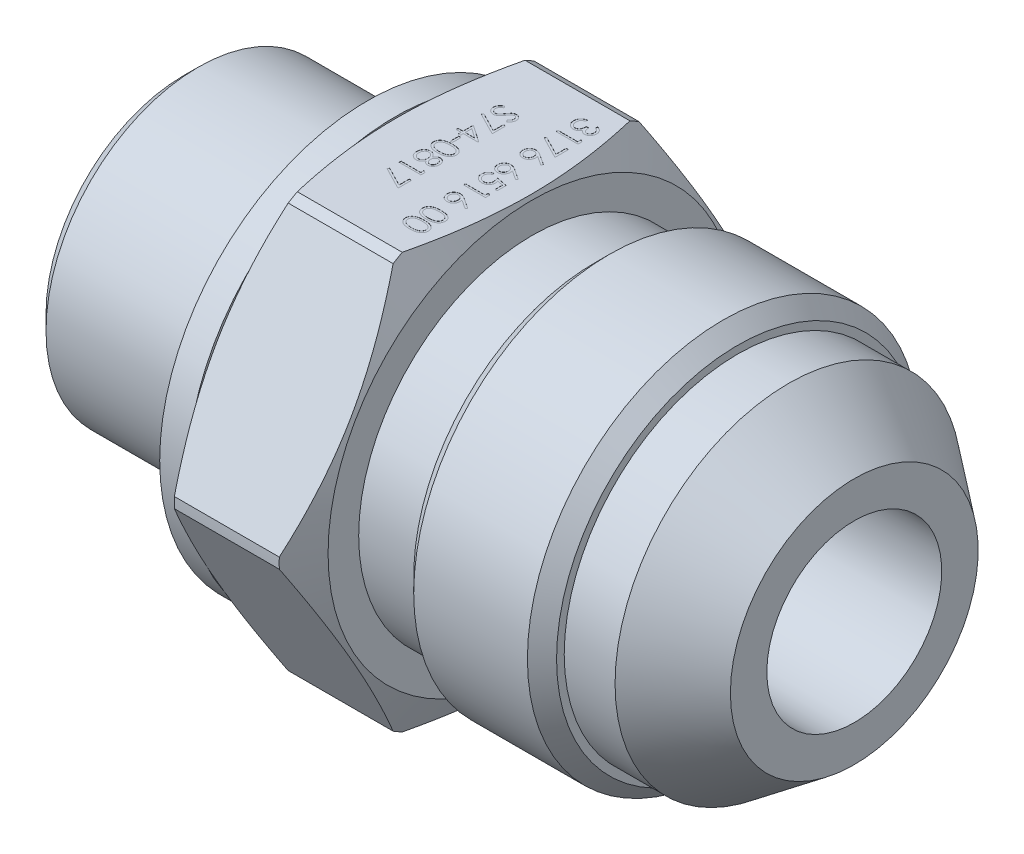
from build123d import *

# Parameters (mm, degrees)
SKETCH2_OUTSIDE_W  = 47.506
SKETCH2_OUTSIDE_H  = 47.506
EXTRUDE1_DEPTH     = 9.4
SKETCH3_R          = 14.25
SKETCH3_R_2        = 11.5
EXTRUDE2_DEPTH     = 1.9
CHAMFER1_SIZE      = 1
CHAMFER2_SIZE      = 1
SKETCH4_W          = 0.153846154
SKETCH4_H          = 0.576923077
CUT_EXTRUDE1_DEPTH = 0.01
SKETCH5_R          = 1.25


with BuildPart() as part:
    # Sketch1 → Revolve1 (revolve)
    with BuildSketch(Plane.XY, mode=Mode.PRIVATE) as revolve1_sk:
        Polygon((0, 7.9), (0, 10.45), (11.55, 10.45), (12.5, 9.5), (14.5, 9.5), (14.5, 14), (15.6, 16.25), (22.8, 16.25), (23.9, 14), (23.9, 11.9), (28.2, 11.9), (28.2, 13.425), (38, 13.425), (38, 11.9), (41.488047606, 11.9), (46, 8.5), (46, 6), (3.290896534, 6), align=None)
    revolve(revolve1_sk.sketch.rotate(Axis((0, 0, 0), (1, 0, 0)), 90), axis=Axis((0, 0, 0), (1, 0, 0)))

    # Sketch2 outside → Extrude1 (cut)
    with BuildSketch(Plane(origin=(23.9, 0, 0), x_dir=(0, 0, -1), z_dir=(1, 0, 0))):
        Rectangle(SKETCH2_OUTSIDE_W, SKETCH2_OUTSIDE_H)
        Polygon((8.227241336, 14.25), (-8.227241336, 14.25), (-16.454482672, 0), (-8.227241336, -14.25), (8.227241336, -14.25), (16.454482672, 0), align=None, mode=Mode.SUBTRACT)
    extrude(amount=-EXTRUDE1_DEPTH, mode=Mode.SUBTRACT)

    # Sketch3 → Extrude2 (add)
    with BuildSketch(Plane.ZY.offset(-14.5)):
        with Locations(Location((0, 0, 0), (0, 0, 180))):
            Circle(SKETCH3_R)
        with Locations(Location((0, 0, 0), (0, 0, 180))):
            Circle(SKETCH3_R_2, mode=Mode.SUBTRACT)
    extrude(amount=EXTRUDE2_DEPTH)

    # Chamfer1
    chamfer1_edges = [part.edges().sort_by_distance(p)[0] for p in [
        (0, 0, -10.45),
    ]]
    chamfer(chamfer1_edges, length=CHAMFER1_SIZE)

    # Chamfer2
    chamfer2_edges = [part.edges().sort_by_distance(p)[0] for p in [
        (28.2, 0, -13.425),
        (38, 0, -13.425),
    ]]
    chamfer(chamfer2_edges, length=CHAMFER2_SIZE)

    # Sketch4 → Cut-Extrude1 (cut)
    # profile 1 of 18: a face of its own
    with BuildSketch(Plane(origin=(0, 14.25, 0), x_dir=(1, 0, 0), z_dir=(0, 1, 0))):
        with BuildLine():
            Line((22.053846154, 6.200171966), (22.053846154, 6.334787351))
            add(Edge.make_bspline(
                [(22.053846154, 6.334787351), (22.06894579, 6.331140401), (22.098464343, 6.324010911), (22.140638884, 6.309140522), (22.180548964, 6.292940842), (22.217447281, 6.273488368), (22.252075383, 6.252270331), (22.283647864, 6.227960593), (22.312967707, 6.201680712), (22.338987666, 6.172612876), (22.36254955, 6.142129164), (22.38263886, 6.109800042), (22.39992064, 6.076275944), (22.414157882, 6.041324602), (22.424883106, 6.004841957), (22.432664595, 5.967157832), (22.437717929, 5.928173475), (22.438211113, 5.901710222), (22.438461538, 5.888272928)],
                knots=[0, 0, 0, 0, 1.162005537, 2.271625781, 3.343758855, 4.383309926, 5.390229558, 6.379919256, 7.361854164, 8.333198761, 9.295911338, 10.242430842, 11.177959212, 12.116337295, 13.062827104, 14.020064771, 14.994644689, 16, 16, 16, 16], degree=3))
            add(Edge.make_bspline(
                [(22.438461538, 5.888272928), (22.43787044, 5.86869461), (22.436701136, 5.829965034), (22.42602352, 5.773066585), (22.409127035, 5.718197948), (22.385781152, 5.665959699), (22.356986589, 5.617437514), (22.322715988, 5.574264862), (22.283630573, 5.537026929), (22.240459474, 5.505786482), (22.194321398, 5.481325768), (22.146835617, 5.46328875), (22.098114772, 5.45230803), (22.065218795, 5.450884934), (22.048737981, 5.450171966)],
                knots=[0, 0, 0, 0, 1.083050992, 2.142477498, 3.193116406, 4.255571735, 5.30263384, 6.308962982, 7.297363603, 8.282367274, 9.249857812, 10.179914175, 11.08814088, 12, 12, 12, 12], degree=3))
            add(Edge.make_bspline(
                [(22.048737981, 5.450171966), (22.032877926, 5.450670648), (22.00184226, 5.451646491), (21.956533047, 5.459932365), (21.913829504, 5.473876478), (21.873551863, 5.49319209), (21.835955503, 5.518195612), (21.800955835, 5.54848391), (21.768397625, 5.584270765), (21.749746422, 5.61139031), (21.740144231, 5.625352255)],
                knots=[0, 0, 0, 0, 1.024540389, 2.004866551, 2.965041327, 3.920577974, 4.882998113, 5.874504559, 6.905732034, 8, 8, 8, 8], degree=3))
            add(Edge.make_bspline(
                [(21.740144231, 5.625352255), (21.7324393, 5.609395789), (21.717173604, 5.577781414), (21.687235422, 5.53468833), (21.652668416, 5.49556924), (21.625692994, 5.473753361), (21.612139423, 5.462792159)],
                knots=[0, 0, 0, 0, 1.015518401, 2.012035669, 3.001164323, 4, 4, 4, 4], degree=3))
            add(Edge.make_bspline(
                [(21.612139423, 5.462792159), (21.602258583, 5.455571502), (21.582658707, 5.441248433), (21.551127711, 5.423618985), (21.519351612, 5.407442777), (21.486081014, 5.395537557), (21.45238463, 5.385263823), (21.417540883, 5.378504049), (21.38188082, 5.374164544), (21.35774509, 5.373555189), (21.345612981, 5.373248889)],
                knots=[0, 0, 0, 0, 1.02516404, 2.033540309, 3.025129118, 4.011046665, 4.991655828, 5.976607087, 6.982917762, 8, 8, 8, 8], degree=3))
            add(Edge.make_bspline(
                [(21.345612981, 5.373248889), (21.32460965, 5.37401966), (21.28270183, 5.375557574), (21.220771564, 5.389248204), (21.16033839, 5.410594808), (21.102297731, 5.440378752), (21.04810634, 5.477229314), (20.999839756, 5.52131346), (20.95807165, 5.57155951), (20.923285944, 5.627638614), (20.89545888, 5.688369194), (20.876149934, 5.753331613), (20.863572699, 5.821581241), (20.862224093, 5.868384423), (20.861538462, 5.892179178)],
                knots=[0, 0, 0, 0, 0.95570045, 1.906903359, 2.87519758, 3.868912786, 4.869932978, 5.851730567, 6.836639976, 7.83677598, 8.849487602, 9.869908895, 10.917060885, 12, 12, 12, 12], degree=3))
            add(Edge.make_bspline(
                [(20.861538462, 5.892179178), (20.861910553, 5.908216021), (20.862642705, 5.93977118), (20.86764782, 5.986161251), (20.87678925, 6.030441979), (20.889090667, 6.072673235), (20.904687128, 6.112892537), (20.924109427, 6.150977153), (20.946957214, 6.187161393), (20.97350018, 6.221103801), (21.003192183, 6.25280033), (21.03656033, 6.28140864), (21.072987788, 6.307405694), (21.11289767, 6.330095397), (21.155774209, 6.350511234), (21.202166422, 6.367303072), (21.251659574, 6.382082602), (21.286150034, 6.388954086), (21.303846154, 6.392479659)],
                knots=[0, 0, 0, 0, 1.048658725, 2.063410685, 3.046034179, 4.001477787, 4.936774919, 5.862367409, 6.792675028, 7.730719943, 8.675894397, 9.627829632, 10.600096036, 11.597688215, 12.626045268, 13.701542398, 14.82072376, 16, 16, 16, 16], degree=3))
            Line((21.303846154, 6.392479659), (21.303846154, 6.257864274))
            add(Edge.make_bspline(
                [(21.303846154, 6.257864274), (21.292296577, 6.254357149), (21.269831646, 6.247535487), (21.237500086, 6.235923645), (21.207860921, 6.222694385), (21.180696726, 6.208502431), (21.155739982, 6.193597383), (21.133650609, 6.176919558), (21.11345838, 6.15970421), (21.102082118, 6.146727344), (21.096514423, 6.140376293)],
                knots=[0, 0, 0, 0, 1.198163088, 2.33053128, 3.407730985, 4.417276592, 5.372219308, 6.28897303, 7.162600585, 8, 8, 8, 8], degree=3))
            add(Edge.make_bspline(
                [(21.096514423, 6.140376293), (21.090039423, 6.13197776), (21.077109409, 6.115206619), (21.060608711, 6.087877377), (21.046311129, 6.059135283), (21.035389545, 6.028357566), (21.026141976, 5.996208378), (21.020090325, 5.962168079), (21.015938252, 5.926536986), (21.015571852, 5.902207944), (21.015384615, 5.889775332)],
                knots=[0, 0, 0, 0, 0.946170439, 1.889420265, 2.845303464, 3.807233317, 4.801018734, 5.828864929, 6.890507805, 8, 8, 8, 8], degree=3))
            add(Edge.make_bspline(
                [(21.015384615, 5.889775332), (21.015648145, 5.875737926), (21.016163456, 5.848288992), (21.020916185, 5.808239564), (21.02780779, 5.770126887), (21.0385876, 5.7343399), (21.051519764, 5.700391631), (21.068450339, 5.669039903), (21.087570687, 5.639363013), (21.109811328, 5.612230358), (21.133851055, 5.587768943), (21.159355062, 5.566631578), (21.18553256, 5.548324202), (21.212994217, 5.533608127), (21.241470656, 5.521967021), (21.271068464, 5.514047025), (21.30153841, 5.508538867), (21.322250868, 5.508090368), (21.332692308, 5.507864274)],
                knots=[0, 0, 0, 0, 1.216990249, 2.379719373, 3.493992396, 4.571561497, 5.616923107, 6.638958652, 7.655775068, 8.674704564, 9.676001865, 10.625896028, 11.54399481, 12.441854662, 13.322657739, 14.20572845, 15.095482574, 16, 16, 16, 16], degree=3))
            add(Edge.make_bspline(
                [(21.332692308, 5.507864274), (21.346668612, 5.508520106), (21.374551675, 5.509828506), (21.415573256, 5.519818072), (21.455098499, 5.536248333), (21.492447365, 5.559253504), (21.527079433, 5.587244337), (21.557858852, 5.619949885), (21.583511722, 5.657450372), (21.601170197, 5.692187233), (21.612938827, 5.723030235), (21.621190771, 5.749372609), (21.627787228, 5.778889787), (21.634167989, 5.811227423), (21.639517213, 5.846521899), (21.643997399, 5.884805014), (21.64757662, 5.92609217), (21.649175877, 5.954674041), (21.65, 5.969402736)],
                knots=[0, 0, 0, 0, 1.070481957, 2.135637345, 3.216366529, 4.339485895, 5.485746587, 6.620975969, 7.768829582, 8.956804399, 9.598399438, 10.297751078, 11.070570279, 11.915248466, 12.824061284, 13.805856426, 14.869322739, 16, 16, 16, 16], degree=3))
            Line((21.65, 5.969402736), (21.803846154, 5.969402736))
            add(Edge.make_bspline(
                [(21.803846154, 5.969402736), (21.804162443, 5.950845606), (21.804781975, 5.914496748), (21.812223222, 5.861391968), (21.822632548, 5.810550419), (21.83820872, 5.763132615), (21.856904571, 5.720053897), (21.87798551, 5.682474461), (21.901869267, 5.651284927), (21.928242391, 5.626407368), (21.956858181, 5.608148124), (21.986371108, 5.594442752), (22.017467841, 5.586408108), (22.038677834, 5.585329506), (22.049338942, 5.584787351)],
                knots=[0, 0, 0, 0, 1.321708579, 2.588902423, 3.815526512, 5.016621128, 6.138757764, 7.158873101, 8.079948563, 8.928590313, 9.728601868, 10.489025425, 11.240515403, 12, 12, 12, 12], degree=3))
            add(Edge.make_bspline(
                [(22.049338942, 5.584787351), (22.05717228, 5.584964935), (22.072756335, 5.58531823), (22.095523946, 5.58977451), (22.117596811, 5.596469395), (22.138874778, 5.605679331), (22.15923434, 5.617984202), (22.178700473, 5.632754145), (22.19759941, 5.649996291), (22.215027003, 5.670161261), (22.231465685, 5.691991992), (22.245676315, 5.715693897), (22.257721235, 5.740744202), (22.267672907, 5.767165942), (22.275154153, 5.795064962), (22.280527023, 5.824304653), (22.283885916, 5.854942305), (22.284369537, 5.875844466), (22.284615385, 5.886470043)],
                knots=[0, 0, 0, 0, 0.884317272, 1.759307272, 2.611736065, 3.488921043, 4.37244062, 5.294096728, 6.247679003, 7.258495569, 8.302441962, 9.333537773, 10.376747089, 11.440883505, 12.520330301, 13.637364711, 14.798958396, 16, 16, 16, 16], degree=3))
            add(Edge.make_bspline(
                [(22.284615385, 5.886470043), (22.284020243, 5.903549894), (22.282857794, 5.936910815), (22.272640387, 5.984995058), (22.256451959, 6.029649727), (22.23690448, 6.063667577), (22.217674998, 6.088830182), (22.201131874, 6.107155884), (22.18237536, 6.124823738), (22.160890986, 6.141140441), (22.137417512, 6.157083725), (22.111825656, 6.172501356), (22.083750553, 6.186898117), (22.064007332, 6.195661662), (22.053846154, 6.200171966)],
                knots=[0, 0, 0, 0, 1.4727372, 2.876598283, 4.222346151, 5.558423782, 6.24313385, 6.953189256, 7.68715613, 8.463578749, 9.278833271, 10.135787152, 11.040551781, 12, 12, 12, 12], degree=3))
        make_face()
    # profile 2 of 18: a face of its own
    with BuildSketch(Plane(origin=(0, 14.25, 0), x_dir=(1, 0, 0), z_dir=(0, 1, 0))):
        Polygon((22.4, 4.919823409), (22.4, 4.642479659), (20.9, 4.642479659), (20.9, 4.777095043), (22.246153846, 4.777095043), (22.246153846, 5.007864274), align=None)
    # profile 3 of 18: a face of its own
    with BuildSketch(Plane(origin=(0, 14.25, 0), x_dir=(1, 0, 0), z_dir=(0, 1, 0))):
        Polygon((22.4, 3.988633505), (22.4, 3.065556582), (20.861538462, 3.85401812), (20.925540865, 3.970304178), (22.246153846, 3.293321005), (22.246153846, 3.988633505), align=None)
    # profile 4 of 18: a face of its own
    with BuildSketch(Plane(origin=(0, 14.25, 0), x_dir=(1, 0, 0), z_dir=(0, 1, 0))):
        with BuildLine():
            Line((22.438461538, 2.238633505), (22.35703125, 2.134967639))
            Line((22.35703125, 2.134967639), (21.750961538, 2.531301774))
            add(Edge.make_bspline(
                [(21.750961538, 2.531301774), (21.755167479, 2.504914512), (21.763371641, 2.453443175), (21.764725046, 2.401343504), (21.765384615, 2.375953216)],
                knots=[0, 0, 0, 0, 1.025318673, 2, 2, 2, 2], degree=3))
            add(Edge.make_bspline(
                [(21.765384615, 2.375953216), (21.764974853, 2.360707861), (21.764168249, 2.330697832), (21.757960884, 2.286637774), (21.748178693, 2.244299658), (21.733919155, 2.203858968), (21.71570386, 2.165170547), (21.693872916, 2.128012377), (21.667299053, 2.093082944), (21.637614072, 2.059932439), (21.604735364, 2.029835111), (21.569849077, 2.00318823), (21.532991557, 1.98080532), (21.494181471, 1.962645067), (21.453478646, 1.948542977), (21.410935157, 1.938262557), (21.366521669, 1.932185589), (21.336316737, 1.931360379), (21.320973558, 1.930941197)],
                knots=[0, 0, 0, 0, 1.04369286, 2.054478336, 3.041073146, 4.015093852, 4.984733326, 5.965804835, 6.960378782, 7.985147595, 9.009457201, 10.008161701, 10.986880575, 11.956520048, 12.937015923, 13.931873656, 14.949455224, 16, 16, 16, 16], degree=3))
            add(Edge.make_bspline(
                [(21.320973558, 1.930941197), (21.299994734, 1.931723995), (21.258737716, 1.933263448), (21.198395966, 1.944470012), (21.141371071, 1.963810037), (21.087438931, 1.989684672), (21.038168706, 2.023254976), (20.993641634, 2.063037632), (20.95482975, 2.109408697), (20.921534651, 2.161270094), (20.895081737, 2.217400232), (20.875524557, 2.276254517), (20.863838646, 2.337329896), (20.862308716, 2.378808481), (20.861538462, 2.399691197)],
                knots=[0, 0, 0, 0, 1.031881447, 2.029301251, 3.006342947, 3.987068354, 4.962916383, 5.929513747, 6.915671209, 7.928552063, 8.953527267, 9.960179832, 10.973036711, 12, 12, 12, 12], degree=3))
            add(Edge.make_bspline(
                [(20.861538462, 2.399691197), (20.862193405, 2.419875501), (20.863490734, 2.459857074), (20.875047589, 2.518671072), (20.893779113, 2.575184009), (20.919585577, 2.628998647), (20.95218053, 2.678853355), (20.991426233, 2.723441789), (21.036455312, 2.762608814), (21.087405898, 2.795032182), (21.141803039, 2.821457314), (21.199040647, 2.840095342), (21.257966794, 2.852148603), (21.298078513, 2.853392161), (21.318269231, 2.85401812)],
                knots=[0, 0, 0, 0, 1.011913813, 2.004424092, 2.994488568, 3.992479987, 4.990471406, 5.973328987, 6.963763268, 7.974390938, 8.994854117, 9.989689954, 10.988086187, 12, 12, 12, 12], degree=3))
            add(Edge.make_bspline(
                [(21.318269231, 2.85401812), (21.333711285, 2.853474499), (21.365226978, 2.852365024), (21.413096452, 2.845743801), (21.461885265, 2.833599669), (21.503244831, 2.820457064), (21.537498045, 2.807415633), (21.564546903, 2.795323317), (21.593111365, 2.781802635), (21.622650965, 2.765954513), (21.654009711, 2.749154225), (21.686026295, 2.729529581), (21.71987006, 2.709050965), (21.742402714, 2.694048852), (21.753966346, 2.686349851)],
                knots=[0, 0, 0, 0, 1.17367173, 2.395347028, 3.66355231, 4.98980831, 5.690886799, 6.447442954, 7.240630024, 8.091733897, 8.994365608, 9.943299771, 10.944512865, 12, 12, 12, 12], degree=3))
            Line((21.753966346, 2.686349851), (22.438461538, 2.238633505))
        make_face()
        with BuildLine():
            add(Edge.make_bspline(
                [(21.611538462, 2.404198409), (21.611200597, 2.415624726), (21.61053771, 2.438043068), (21.606793718, 2.470892524), (21.599699879, 2.501898458), (21.590523836, 2.531415007), (21.57803001, 2.559134533), (21.563033878, 2.585373231), (21.545204456, 2.609870739), (21.52474054, 2.632196838), (21.502662786, 2.65269771), (21.478873862, 2.670331808), (21.454100562, 2.685559569), (21.428110047, 2.69793647), (21.400918988, 2.707575348), (21.372650657, 2.714547381), (21.343115977, 2.718427581), (21.323087758, 2.719073106), (21.312860577, 2.719402736)],
                knots=[0, 0, 0, 0, 1.129474985, 2.216020618, 3.260639938, 4.268601163, 5.26556745, 6.258792394, 7.250684778, 8.252748164, 9.247500881, 10.223461414, 11.174097059, 12.117127289, 13.062595836, 14.020469732, 14.98917545, 16, 16, 16, 16], degree=3))
            add(Edge.make_bspline(
                [(21.312860577, 2.719402736), (21.302725257, 2.719133603), (21.282851404, 2.718605875), (21.253557678, 2.71383618), (21.225393368, 2.706498408), (21.198337873, 2.695757855), (21.172538778, 2.68228606), (21.147812823, 2.665707532), (21.124142941, 2.646302983), (21.102126005, 2.623745581), (21.081931536, 2.59941961), (21.063950342, 2.573693284), (21.048850948, 2.546648404), (21.036913687, 2.518130647), (21.027136785, 2.488539287), (21.020251936, 2.457648579), (21.01636065, 2.425431381), (21.01571423, 2.403607729), (21.015384615, 2.392479659)],
                knots=[0, 0, 0, 0, 0.989642335, 1.94054129, 2.892446913, 3.828371744, 4.778262963, 5.730973156, 6.732161388, 7.763274768, 8.805796303, 9.818398792, 10.825975928, 11.825728216, 12.834635236, 13.867465554, 14.912602056, 16, 16, 16, 16], degree=3))
            add(Edge.make_bspline(
                [(21.015384615, 2.392479659), (21.015714204, 2.38135157), (21.016360573, 2.359527882), (21.020252227, 2.327310944), (21.027135718, 2.296419278), (21.036917555, 2.266831399), (21.048836597, 2.238300789), (21.064044957, 2.211232235), (21.081822209, 2.185260291), (21.102160762, 2.160950279), (21.124018536, 2.138298593), (21.148027137, 2.119348542), (21.172342259, 2.10224626), (21.198440681, 2.089291879), (21.225377081, 2.07843171), (21.253562042, 2.07113096), (21.282850261, 2.066351394), (21.302724871, 2.065825022), (21.312860577, 2.065556582)],
                knots=[0, 0, 0, 0, 1.087205562, 2.132157158, 3.164804748, 4.173533273, 5.173108684, 6.180507559, 7.20098426, 8.243321352, 9.274252308, 10.269075238, 11.227079059, 12.172305571, 13.108064818, 14.05980203, 15.010532752, 16, 16, 16, 16], degree=3))
            add(Edge.make_bspline(
                [(21.312860577, 2.065556582), (21.323102287, 2.065789673), (21.343203434, 2.066247155), (21.372624048, 2.07152173), (21.401148857, 2.078645921), (21.428135293, 2.090159267), (21.454329641, 2.103872603), (21.478983246, 2.121342491), (21.502794549, 2.141372146), (21.524886963, 2.164568429), (21.545094483, 2.189803909), (21.562931005, 2.216640003), (21.57798468, 2.244714627), (21.590544836, 2.274000661), (21.599608905, 2.304833309), (21.606746007, 2.336714888), (21.610544015, 2.370053133), (21.611202757, 2.39267168), (21.611538462, 2.404198409)],
                knots=[0, 0, 0, 0, 0.978265087, 1.920016216, 2.851775529, 3.783928695, 4.718195979, 5.674835085, 6.667117013, 7.690134047, 8.732874136, 9.755756613, 10.767227014, 11.776017537, 12.797239016, 13.836276431, 14.897336092, 16, 16, 16, 16], degree=3))
        make_face(mode=Mode.SUBTRACT)
    # profile 5 of 18: a face of its own
    with BuildSketch(Plane(origin=(0, 14.25, 0), x_dir=(1, 0, 0), z_dir=(0, 1, 0))):
        with BuildLine():
            Line((22.438461538, 0.507864274), (22.35703125, 0.404198409))
            Line((22.35703125, 0.404198409), (21.750961538, 0.800532543))
            add(Edge.make_bspline(
                [(21.750961538, 0.800532543), (21.755167479, 0.774145282), (21.763371641, 0.722673944), (21.764725046, 0.670574274), (21.765384615, 0.645183986)],
                knots=[0, 0, 0, 0, 1.025318673, 2, 2, 2, 2], degree=3))
            add(Edge.make_bspline(
                [(21.765384615, 0.645183986), (21.764974853, 0.62993863), (21.764168249, 0.599928601), (21.757960884, 0.555868543), (21.748178693, 0.513530428), (21.733919155, 0.473089737), (21.71570386, 0.434401316), (21.693872916, 0.397243146), (21.667299053, 0.362313713), (21.637614072, 0.329163208), (21.604735364, 0.29906588), (21.569849077, 0.272419), (21.532991557, 0.250036089), (21.494181471, 0.231875837), (21.453478646, 0.217773746), (21.410935157, 0.207493327), (21.366521669, 0.201416358), (21.336316737, 0.200591148), (21.320973558, 0.200171966)],
                knots=[0, 0, 0, 0, 1.04369286, 2.054478336, 3.041073146, 4.015093852, 4.984733326, 5.965804835, 6.960378782, 7.985147595, 9.009457201, 10.008161701, 10.986880575, 11.956520048, 12.937015923, 13.931873656, 14.949455224, 16, 16, 16, 16], degree=3))
            add(Edge.make_bspline(
                [(21.320973558, 0.200171966), (21.299994734, 0.200954764), (21.258737716, 0.202494217), (21.198395966, 0.213700781), (21.141371071, 0.233040806), (21.087438931, 0.258915441), (21.038168706, 0.292485745), (20.993641634, 0.332268401), (20.95482975, 0.378639466), (20.921534651, 0.430500863), (20.895081737, 0.486631001), (20.875524557, 0.545485287), (20.863838646, 0.606560665), (20.862308716, 0.648039251), (20.861538462, 0.668921966)],
                knots=[0, 0, 0, 0, 1.031881447, 2.029301251, 3.006342947, 3.987068354, 4.962916383, 5.929513747, 6.915671209, 7.928552063, 8.953527267, 9.960179832, 10.973036711, 12, 12, 12, 12], degree=3))
            add(Edge.make_bspline(
                [(20.861538462, 0.668921966), (20.862193405, 0.68910627), (20.863490734, 0.729087843), (20.875047589, 0.787901841), (20.893779113, 0.844414778), (20.919585577, 0.898229416), (20.95218053, 0.948084125), (20.991426233, 0.992672558), (21.036455312, 1.031839583), (21.087405898, 1.064262951), (21.141803039, 1.090688083), (21.199040647, 1.109326111), (21.257966794, 1.121379373), (21.298078513, 1.12262293), (21.318269231, 1.123248889)],
                knots=[0, 0, 0, 0, 1.011913813, 2.004424092, 2.994488568, 3.992479987, 4.990471406, 5.973328987, 6.963763268, 7.974390938, 8.994854117, 9.989689954, 10.988086187, 12, 12, 12, 12], degree=3))
            add(Edge.make_bspline(
                [(21.318269231, 1.123248889), (21.333711285, 1.122705269), (21.365226978, 1.121595793), (21.413096452, 1.11497457), (21.461885265, 1.102830438), (21.503244831, 1.089687833), (21.537498045, 1.076646402), (21.564546903, 1.064554086), (21.593111365, 1.051033404), (21.622650965, 1.035185282), (21.654009711, 1.018384994), (21.686026295, 0.998760351), (21.71987006, 0.978281734), (21.742402714, 0.963279621), (21.753966346, 0.95558062)],
                knots=[0, 0, 0, 0, 1.17367173, 2.395347028, 3.66355231, 4.98980831, 5.690886799, 6.447442954, 7.240630024, 8.091733897, 8.994365608, 9.943299771, 10.944512865, 12, 12, 12, 12], degree=3))
            Line((21.753966346, 0.95558062), (22.438461538, 0.507864274))
        make_face()
        with BuildLine():
            add(Edge.make_bspline(
                [(21.611538462, 0.673429178), (21.611200597, 0.684855496), (21.61053771, 0.707273837), (21.606793718, 0.740123293), (21.599699879, 0.771129227), (21.590523836, 0.800645777), (21.57803001, 0.828365302), (21.563033878, 0.854604001), (21.545204456, 0.879101508), (21.52474054, 0.901427607), (21.502662786, 0.921928479), (21.478873862, 0.939562578), (21.454100562, 0.954790339), (21.428110047, 0.967167239), (21.400918988, 0.976806118), (21.372650657, 0.983778151), (21.343115977, 0.98765835), (21.323087758, 0.988303875), (21.312860577, 0.988633505)],
                knots=[0, 0, 0, 0, 1.129474985, 2.216020618, 3.260639938, 4.268601163, 5.26556745, 6.258792394, 7.250684778, 8.252748164, 9.247500881, 10.223461414, 11.174097059, 12.117127289, 13.062595836, 14.020469732, 14.98917545, 16, 16, 16, 16], degree=3))
            add(Edge.make_bspline(
                [(21.312860577, 0.988633505), (21.302725257, 0.988364372), (21.282851404, 0.987836644), (21.253557678, 0.983066949), (21.225393368, 0.975729177), (21.198337873, 0.964988624), (21.172538778, 0.951516829), (21.147812823, 0.934938301), (21.124142941, 0.915533753), (21.102126005, 0.892976351), (21.081931536, 0.868650379), (21.063950342, 0.842924053), (21.048850948, 0.815879173), (21.036913687, 0.787361417), (21.027136785, 0.757770056), (21.020251936, 0.726879348), (21.01636065, 0.694662151), (21.01571423, 0.672838499), (21.015384615, 0.661710428)],
                knots=[0, 0, 0, 0, 0.989642335, 1.94054129, 2.892446913, 3.828371744, 4.778262963, 5.730973156, 6.732161388, 7.763274768, 8.805796303, 9.818398792, 10.825975928, 11.825728216, 12.834635236, 13.867465554, 14.912602056, 16, 16, 16, 16], degree=3))
            add(Edge.make_bspline(
                [(21.015384615, 0.661710428), (21.015714204, 0.650582339), (21.016360573, 0.628758651), (21.020252227, 0.596541713), (21.027135718, 0.565650047), (21.036917555, 0.536062168), (21.048836597, 0.507531559), (21.064044957, 0.480463004), (21.081822209, 0.454491061), (21.102160762, 0.430181048), (21.124018536, 0.407529362), (21.148027137, 0.388579311), (21.172342259, 0.371477029), (21.198440681, 0.358522649), (21.225377081, 0.347662479), (21.253562042, 0.340361729), (21.282850261, 0.335582164), (21.302724871, 0.335055792), (21.312860577, 0.334787351)],
                knots=[0, 0, 0, 0, 1.087205562, 2.132157158, 3.164804748, 4.173533273, 5.173108684, 6.180507559, 7.20098426, 8.243321352, 9.274252308, 10.269075238, 11.227079059, 12.172305571, 13.108064818, 14.05980203, 15.010532752, 16, 16, 16, 16], degree=3))
            add(Edge.make_bspline(
                [(21.312860577, 0.334787351), (21.323102287, 0.335020442), (21.343203434, 0.335477924), (21.372624048, 0.340752499), (21.401148857, 0.34787669), (21.428135293, 0.359390037), (21.454329641, 0.373103372), (21.478983246, 0.39057326), (21.502794549, 0.410602915), (21.524886963, 0.433799198), (21.545094483, 0.459034678), (21.562931005, 0.485870772), (21.57798468, 0.513945396), (21.590544836, 0.54323143), (21.599608905, 0.574064078), (21.606746007, 0.605945657), (21.610544015, 0.639283902), (21.611202757, 0.661902449), (21.611538462, 0.673429178)],
                knots=[0, 0, 0, 0, 0.978265087, 1.920016216, 2.851775529, 3.783928695, 4.718195979, 5.674835085, 6.667117013, 7.690134047, 8.732874136, 9.755756613, 10.767227014, 11.776017537, 12.797239016, 13.836276431, 14.897336092, 16, 16, 16, 16], degree=3))
        make_face(mode=Mode.SUBTRACT)
    # profile 6 of 18: a face of its own
    with BuildSketch(Plane(origin=(0, 14.25, 0), x_dir=(1, 0, 0), z_dir=(0, 1, 0))):
        with BuildLine():
            Line((22.4, -0.89598188), (22.246153846, -0.89598188))
            Line((22.246153846, -0.89598188), (22.246153846, -0.385765534))
            Line((22.246153846, -0.385765534), (21.851622596, -0.304936207))
            add(Edge.make_bspline(
                [(21.851622596, -0.304936207), (21.856006998, -0.320817296), (21.864501084, -0.351584394), (21.873932129, -0.396995763), (21.879617319, -0.440106707), (21.880393595, -0.468081866), (21.880769231, -0.481618899)],
                knots=[0, 0, 0, 0, 1.100273476, 2.13160584, 3.095893838, 4, 4, 4, 4], degree=3))
            add(Edge.make_bspline(
                [(21.880769231, -0.481618899), (21.880406592, -0.498369015), (21.879693554, -0.531303929), (21.872849824, -0.579492871), (21.862070678, -0.625489699), (21.847036799, -0.669215827), (21.827688397, -0.710765436), (21.803832222, -0.749906493), (21.775633286, -0.786860826), (21.743363659, -0.821139912), (21.707804675, -0.852189665), (21.669696552, -0.879597379), (21.629004627, -0.902391751), (21.585908837, -0.921145023), (21.540481492, -0.936023934), (21.492386339, -0.945954185), (21.442050179, -0.952559143), (21.407634109, -0.953297615), (21.390084135, -0.953674188)],
                knots=[0, 0, 0, 0, 1.052772836, 2.070014431, 3.053871312, 4.019926262, 4.972333346, 5.930471369, 6.896690565, 7.89035727, 8.885779078, 9.861050232, 10.836829716, 11.812751485, 12.812646763, 13.836748493, 14.896881366, 16, 16, 16, 16], degree=3))
            add(Edge.make_bspline(
                [(21.390084135, -0.953674188), (21.37786031, -0.953389194), (21.353577855, -0.952823057), (21.31751629, -0.9499431), (21.282217058, -0.944401315), (21.247680689, -0.936950278), (21.213953354, -0.927317709), (21.181047322, -0.91553015), (21.148861269, -0.901635524), (21.117393088, -0.885948163), (21.087612891, -0.867800793), (21.059060977, -0.848684657), (21.032788117, -0.827509239), (21.007835176, -0.805299749), (20.985182096, -0.781168121), (20.963859452, -0.755863361), (20.944793457, -0.72879163), (20.927257045, -0.700437613), (20.911555624, -0.67081919), (20.898457833, -0.639636035), (20.886977507, -0.6075727), (20.877641645, -0.574343409), (20.870398365, -0.540012536), (20.86546579, -0.504461861), (20.861876912, -0.46786977), (20.861652048, -0.443066245), (20.861538462, -0.430537168)],
                knots=[0, 0, 0, 0, 1.05623316, 2.098192244, 3.122504159, 4.140841222, 5.148757784, 6.150489607, 7.158294732, 8.176043417, 9.185147859, 10.169157858, 11.142149047, 12.097904048, 13.0527185, 13.998867679, 14.954465986, 15.910220987, 16.877849176, 17.847023716, 18.829548819, 19.818454515, 20.826519638, 21.858115382, 22.918063636, 24, 24, 24, 24], degree=3))
            add(Edge.make_bspline(
                [(20.861538462, -0.430537168), (20.861834561, -0.415591109), (20.862417101, -0.386186503), (20.868510368, -0.343106), (20.877239111, -0.301657835), (20.890364022, -0.262170036), (20.906833873, -0.224309443), (20.927517129, -0.188580052), (20.951283131, -0.154279587), (20.978951886, -0.122340292), (21.009477725, -0.092756922), (21.04224906, -0.065868208), (21.077396196, -0.042286967), (21.114619914, -0.021916966), (21.153984261, -0.004566746), (21.195607032, 0.009069925), (21.239278838, 0.020074475), (21.269344576, 0.02473029), (21.284615385, 0.027095043)],
                knots=[0, 0, 0, 0, 1.046825758, 2.059506013, 3.044032586, 4.011925612, 4.970610144, 5.93275819, 6.900651216, 7.891265644, 8.889116719, 9.876966323, 10.858259055, 11.851035124, 12.847502422, 13.86866322, 14.9174643, 16, 16, 16, 16], degree=3))
            Line((21.284615385, 0.027095043), (21.284615385, -0.107520341))
            add(Edge.make_bspline(
                [(21.284615385, -0.107520341), (21.270309826, -0.110830496), (21.242813748, -0.117192796), (21.204204192, -0.131194429), (21.169668325, -0.14820847), (21.139173543, -0.168900262), (21.112441618, -0.193083946), (21.088413982, -0.220481982), (21.067024308, -0.251484691), (21.049080204, -0.28592231), (21.033799099, -0.322275333), (21.023618336, -0.360317209), (21.016461193, -0.399019389), (21.015744673, -0.42519579), (21.015384615, -0.438349668)],
                knots=[0, 0, 0, 0, 1.136389429, 2.184203582, 3.172920998, 4.111012962, 5.028380909, 5.957351669, 6.927793475, 7.937618031, 8.960409703, 9.974842029, 10.982339866, 12, 12, 12, 12], degree=3))
            add(Edge.make_bspline(
                [(21.015384615, -0.438349668), (21.015736377, -0.451189002), (21.016429, -0.476469754), (21.021760005, -0.513674634), (21.029970392, -0.549594437), (21.042257473, -0.583874733), (21.057190924, -0.617115393), (21.076354528, -0.64847558), (21.098408821, -0.678862527), (21.123675949, -0.707331728), (21.151520103, -0.733405777), (21.181296129, -0.756444115), (21.213060492, -0.775634221), (21.246263272, -0.791805982), (21.281268368, -0.804085967), (21.317911728, -0.812846387), (21.356283863, -0.817990555), (21.382456424, -0.818698204), (21.395793269, -0.819058803)],
                knots=[0, 0, 0, 0, 1.027316725, 2.022795036, 3.002884548, 3.971462791, 4.93288096, 5.914575861, 6.907176829, 7.935150275, 8.956128384, 9.956726525, 10.942570165, 11.921478529, 12.907843606, 13.90538589, 14.932640048, 16, 16, 16, 16], degree=3))
            add(Edge.make_bspline(
                [(21.395793269, -0.819058803), (21.407832984, -0.818822052), (21.431412519, -0.818358379), (21.465757877, -0.813205837), (21.498491003, -0.805987925), (21.529319175, -0.794905742), (21.558693828, -0.781212765), (21.585986236, -0.763840586), (21.61189759, -0.743982395), (21.63537525, -0.720722962), (21.65719029, -0.695359538), (21.675759753, -0.667303354), (21.69138892, -0.637194349), (21.704874715, -0.605381003), (21.714560886, -0.571110516), (21.721832798, -0.535060479), (21.726039393, -0.496841904), (21.726623058, -0.470711607), (21.726923077, -0.457279957)],
                knots=[0, 0, 0, 0, 1.045726679, 2.048034203, 3.01323695, 3.95502507, 4.889743367, 5.8246644, 6.761650845, 7.722168973, 8.692072792, 9.66525385, 10.638902184, 11.638179751, 12.663148338, 13.728659964, 14.832472288, 16, 16, 16, 16], degree=3))
            add(Edge.make_bspline(
                [(21.726923077, -0.457279957), (21.726682702, -0.445552304), (21.726190616, -0.421543978), (21.722318005, -0.384631219), (21.716360365, -0.346010247), (21.707773504, -0.305531125), (21.697022163, -0.26330494), (21.683595087, -0.21926147), (21.668128788, -0.17339965), (21.6561326, -0.142531361), (21.65, -0.126751111)],
                knots=[0, 0, 0, 0, 0.824638674, 1.688163388, 2.607705698, 3.571998603, 4.597075385, 5.671199175, 6.809488238, 8, 8, 8, 8], degree=3))
            Line((21.65, -0.126751111), (22.4, -0.280597264))
            Line((22.4, -0.280597264), (22.4, -0.89598188))
        make_face()
    # profile 7 of 18: a face of its own
    with BuildSketch(Plane(origin=(0, 14.25, 0), x_dir=(1, 0, 0), z_dir=(0, 1, 0))):
        Polygon((22.4, -1.426330438), (22.4, -1.703674188), (20.9, -1.703674188), (20.9, -1.569058803), (22.246153846, -1.569058803), (22.246153846, -1.338289572), align=None)
    # profile 8 of 18: a face of its own
    with BuildSketch(Plane(origin=(0, 14.25, 0), x_dir=(1, 0, 0), z_dir=(0, 1, 0))):
        with BuildLine():
            Line((22.438461538, -2.953674188), (22.35703125, -3.057340053))
            Line((22.35703125, -3.057340053), (21.750961538, -2.661005918))
            add(Edge.make_bspline(
                [(21.750961538, -2.661005918), (21.755167479, -2.68739318), (21.763371641, -2.738864517), (21.764725046, -2.790964188), (21.765384615, -2.816354476)],
                knots=[0, 0, 0, 0, 1.025318673, 2, 2, 2, 2], degree=3))
            add(Edge.make_bspline(
                [(21.765384615, -2.816354476), (21.764974853, -2.831599832), (21.764168249, -2.86160986), (21.757960884, -2.905669918), (21.748178693, -2.948008034), (21.733919155, -2.988448725), (21.71570386, -3.027137146), (21.693872916, -3.064295315), (21.667299053, -3.099224748), (21.637614072, -3.132375254), (21.604735364, -3.162472581), (21.569849077, -3.189119462), (21.532991557, -3.211502373), (21.494181471, -3.229662625), (21.453478646, -3.243764716), (21.410935157, -3.254045135), (21.366521669, -3.260122103), (21.336316737, -3.260947314), (21.320973558, -3.261366495)],
                knots=[0, 0, 0, 0, 1.04369286, 2.054478336, 3.041073146, 4.015093852, 4.984733326, 5.965804835, 6.960378782, 7.985147595, 9.009457201, 10.008161701, 10.986880575, 11.956520048, 12.937015923, 13.931873656, 14.949455224, 16, 16, 16, 16], degree=3))
            add(Edge.make_bspline(
                [(21.320973558, -3.261366495), (21.299994734, -3.260583697), (21.258737716, -3.259044244), (21.198395966, -3.24783768), (21.141371071, -3.228497655), (21.087438931, -3.20262302), (21.038168706, -3.169052716), (20.993641634, -3.129270061), (20.95482975, -3.082898996), (20.921534651, -3.031037598), (20.895081737, -2.974907461), (20.875524557, -2.916053175), (20.863838646, -2.854977796), (20.862308716, -2.813499211), (20.861538462, -2.792616495)],
                knots=[0, 0, 0, 0, 1.031881447, 2.029301251, 3.006342947, 3.987068354, 4.962916383, 5.929513747, 6.915671209, 7.928552063, 8.953527267, 9.960179832, 10.973036711, 12, 12, 12, 12], degree=3))
            add(Edge.make_bspline(
                [(20.861538462, -2.792616495), (20.862193405, -2.772432191), (20.863490734, -2.732450618), (20.875047589, -2.673636621), (20.893779113, -2.617123684), (20.919585577, -2.563309046), (20.95218053, -2.513454337), (20.991426233, -2.468865903), (21.036455312, -2.429698878), (21.087405898, -2.397275511), (21.141803039, -2.370850378), (21.199040647, -2.35221235), (21.257966794, -2.340159089), (21.298078513, -2.338915532), (21.318269231, -2.338289572)],
                knots=[0, 0, 0, 0, 1.011913813, 2.004424092, 2.994488568, 3.992479987, 4.990471406, 5.973328987, 6.963763268, 7.974390938, 8.994854117, 9.989689954, 10.988086187, 12, 12, 12, 12], degree=3))
            add(Edge.make_bspline(
                [(21.318269231, -2.338289572), (21.333711285, -2.338833193), (21.365226978, -2.339942669), (21.413096452, -2.346563891), (21.461885265, -2.358708023), (21.503244831, -2.371850628), (21.537498045, -2.38489206), (21.564546903, -2.396984375), (21.593111365, -2.410505057), (21.622650965, -2.426353179), (21.654009711, -2.443153468), (21.686026295, -2.462778111), (21.71987006, -2.483256728), (21.742402714, -2.49825884), (21.753966346, -2.505957841)],
                knots=[0, 0, 0, 0, 1.17367173, 2.395347028, 3.66355231, 4.98980831, 5.690886799, 6.447442954, 7.240630024, 8.091733897, 8.994365608, 9.943299771, 10.944512865, 12, 12, 12, 12], degree=3))
            Line((21.753966346, -2.505957841), (22.438461538, -2.953674188))
        make_face()
        with BuildLine():
            add(Edge.make_bspline(
                [(21.611538462, -2.788109284), (21.611200597, -2.776682966), (21.61053771, -2.754264624), (21.606793718, -2.721415168), (21.599699879, -2.690409234), (21.590523836, -2.660892685), (21.57803001, -2.63317316), (21.563033878, -2.606934461), (21.545204456, -2.582436953), (21.52474054, -2.560110855), (21.502662786, -2.539609982), (21.478873862, -2.521975884), (21.454100562, -2.506748123), (21.428110047, -2.494371222), (21.400918988, -2.484732344), (21.372650657, -2.477760311), (21.343115977, -2.473880112), (21.323087758, -2.473234587), (21.312860577, -2.472904957)],
                knots=[0, 0, 0, 0, 1.129474985, 2.216020618, 3.260639938, 4.268601163, 5.26556745, 6.258792394, 7.250684778, 8.252748164, 9.247500881, 10.223461414, 11.174097059, 12.117127289, 13.062595836, 14.020469732, 14.98917545, 16, 16, 16, 16], degree=3))
            add(Edge.make_bspline(
                [(21.312860577, -2.472904957), (21.302725257, -2.473174089), (21.282851404, -2.473701817), (21.253557678, -2.478471513), (21.225393368, -2.485809284), (21.198337873, -2.496549838), (21.172538778, -2.510021632), (21.147812823, -2.526600161), (21.124142941, -2.546004709), (21.102126005, -2.568562111), (21.081931536, -2.592888082), (21.063950342, -2.618614408), (21.048850948, -2.645659289), (21.036913687, -2.674177045), (21.027136785, -2.703768406), (21.020251936, -2.734659114), (21.01636065, -2.766876311), (21.01571423, -2.788699963), (21.015384615, -2.799828034)],
                knots=[0, 0, 0, 0, 0.989642335, 1.94054129, 2.892446913, 3.828371744, 4.778262963, 5.730973156, 6.732161388, 7.763274768, 8.805796303, 9.818398792, 10.825975928, 11.825728216, 12.834635236, 13.867465554, 14.912602056, 16, 16, 16, 16], degree=3))
            add(Edge.make_bspline(
                [(21.015384615, -2.799828034), (21.015714204, -2.810956123), (21.016360573, -2.83277981), (21.020252227, -2.864996749), (21.027135718, -2.895888415), (21.036917555, -2.925476293), (21.048836597, -2.954006903), (21.064044957, -2.981075457), (21.081822209, -3.007047401), (21.102160762, -3.031357414), (21.124018536, -3.054009099), (21.148027137, -3.072959151), (21.172342259, -3.090061432), (21.198440681, -3.103015813), (21.225377081, -3.113875983), (21.253562042, -3.121176732), (21.282850261, -3.125956298), (21.302724871, -3.12648267), (21.312860577, -3.126751111)],
                knots=[0, 0, 0, 0, 1.087205562, 2.132157158, 3.164804748, 4.173533273, 5.173108684, 6.180507559, 7.20098426, 8.243321352, 9.274252308, 10.269075238, 11.227079059, 12.172305571, 13.108064818, 14.05980203, 15.010532752, 16, 16, 16, 16], degree=3))
            add(Edge.make_bspline(
                [(21.312860577, -3.126751111), (21.323102287, -3.12651802), (21.343203434, -3.126060538), (21.372624048, -3.120785963), (21.401148857, -3.113661771), (21.428135293, -3.102148425), (21.454329641, -3.08843509), (21.478983246, -3.070965201), (21.502794549, -3.050935547), (21.524886963, -3.027739263), (21.545094483, -3.002503783), (21.562931005, -2.97566769), (21.57798468, -2.947593066), (21.590544836, -2.918307031), (21.599608905, -2.887474383), (21.606746007, -2.855592805), (21.610544015, -2.822254559), (21.611202757, -2.799636013), (21.611538462, -2.788109284)],
                knots=[0, 0, 0, 0, 0.978265087, 1.920016216, 2.851775529, 3.783928695, 4.718195979, 5.674835085, 6.667117013, 7.690134047, 8.732874136, 9.755756613, 10.767227014, 11.776017537, 12.797239016, 13.836276431, 14.897336092, 16, 16, 16, 16], degree=3))
        make_face(mode=Mode.SUBTRACT)
    # profile 9 of 18: a face of its own
    with BuildSketch(Plane(origin=(0, 14.25, 0), x_dir=(1, 0, 0), z_dir=(0, 1, 0))):
        with BuildLine():
            add(Edge.make_bspline(
                [(21.649399038, -3.992135726), (21.673440776, -3.992276305), (21.720142198, -3.992549382), (21.788192759, -3.995587277), (21.852032883, -4.000633852), (21.911665624, -4.00754987), (21.967106384, -4.015966144), (22.018206983, -4.027201365), (22.065203995, -4.039978239), (22.10825046, -4.054786569), (22.147927057, -4.071495142), (22.184964882, -4.089682945), (22.219316911, -4.110061857), (22.251499205, -4.131501984), (22.281152593, -4.154786803), (22.30822092, -4.179670719), (22.332720528, -4.206400569), (22.354943007, -4.234447698), (22.374301618, -4.263989355), (22.391745014, -4.294114871), (22.406061876, -4.325355833), (22.417825741, -4.357427316), (22.427251829, -4.390236051), (22.433779376, -4.423917601), (22.437870393, -4.458480104), (22.438262621, -4.4818076), (22.438461538, -4.49363813)],
                knots=[0, 0, 0, 0, 1.646377244, 3.198111528, 4.663803227, 6.031090796, 7.308794487, 8.502186765, 9.612154809, 10.642545331, 11.617106989, 12.558866172, 13.465886467, 14.35053239, 15.20542558, 16.045215227, 16.865619885, 17.686225247, 18.492864914, 19.282407821, 20.068097601, 20.842842034, 21.620163247, 22.403093475, 23.190129512, 24, 24, 24, 24], degree=3))
            add(Edge.make_bspline(
                [(22.438461538, -4.49363813), (22.438252475, -4.505567621), (22.437836713, -4.529291624), (22.433840738, -4.564366071), (22.427210256, -4.59863022), (22.417815553, -4.631937994), (22.406160263, -4.664562988), (22.391551498, -4.69625002), (22.37454627, -4.727195912), (22.354564608, -4.756908893), (22.332286489, -4.785715156), (22.307102489, -4.81290714), (22.279266895, -4.83848732), (22.249077524, -4.862776737), (22.215955345, -4.885086278), (22.180476441, -4.906332035), (22.142020356, -4.925348622), (22.101228727, -4.943663483), (22.056972873, -4.959472191), (22.009502262, -4.973729153), (21.958256181, -4.985248711), (21.903503505, -4.994844114), (21.845043155, -5.002277641), (21.783000448, -5.00769163), (21.717334567, -5.010551524), (21.672438346, -5.01109011), (21.649399038, -5.011366495)],
                knots=[0, 0, 0, 0, 0.810914788, 1.612654377, 2.396697861, 3.181598691, 3.963628158, 4.749916497, 5.551656086, 6.361998678, 7.18212741, 8.025565596, 8.878627764, 9.750805457, 10.657531673, 11.591944965, 12.560506719, 13.57287815, 14.630710178, 15.753379473, 16.941251878, 18.199788006, 19.531962791, 20.947069417, 22.433333509, 24, 24, 24, 24], degree=3))
            add(Edge.make_bspline(
                [(21.649399038, -5.011366495), (21.626460307, -5.0110869), (21.581765123, -5.010542119), (21.51639352, -5.007727441), (21.454684236, -5.00215699), (21.396465496, -4.99526722), (21.342082962, -4.985452839), (21.291019524, -4.974295616), (21.24371585, -4.960428386), (21.199693398, -4.944835151), (21.159101622, -4.926917705), (21.120977972, -4.907733046), (21.085528017, -4.886617701), (21.052406319, -4.86417511), (21.021955129, -4.84009215), (20.994099186, -4.814403654), (20.968856866, -4.787090067), (20.946274359, -4.758218675), (20.926525297, -4.728038268), (20.908872813, -4.697195669), (20.894548917, -4.665075289), (20.882454974, -4.632390976), (20.873038657, -4.598834334), (20.866591369, -4.564438276), (20.862057108, -4.529315448), (20.861711942, -4.505571748), (20.861538462, -4.49363813)],
                knots=[0, 0, 0, 0, 1.56130642, 3.042141888, 4.451772327, 5.777565838, 7.030558081, 8.211376819, 9.333164717, 10.383253789, 11.387583522, 12.350962576, 13.286244149, 14.193812918, 15.072134482, 15.925989337, 16.770211267, 17.600669898, 18.417446232, 19.22325363, 20.01647746, 20.807971184, 21.593601364, 22.38506573, 23.188331689, 24, 24, 24, 24], degree=3))
            add(Edge.make_bspline(
                [(20.861538462, -4.49363813), (20.861739294, -4.481808081), (20.862135295, -4.458481532), (20.866198664, -4.423912087), (20.87282465, -4.390283067), (20.881822705, -4.357527244), (20.893258701, -4.325577583), (20.907804863, -4.294747063), (20.924676148, -4.264628518), (20.943870392, -4.235359381), (20.965866496, -4.207497504), (20.990193534, -4.180883254), (21.017461677, -4.156188631), (21.047234457, -4.133195644), (21.079259252, -4.111376548), (21.11385153, -4.091197335), (21.151236377, -4.073045007), (21.191132001, -4.055961981), (21.234494836, -4.040903327), (21.281742511, -4.027702055), (21.333136389, -4.016696949), (21.388523897, -4.007846585), (21.44794649, -4.00055035), (21.511508794, -3.995611173), (21.579155969, -3.992546963), (21.62555741, -3.992275306), (21.649399038, -3.992135726)],
                knots=[0, 0, 0, 0, 0.810940842, 1.599017053, 2.38298203, 3.159479784, 3.926441347, 4.70693857, 5.494146311, 6.292334103, 7.104379492, 7.925868426, 8.762126819, 9.623561095, 10.503686106, 11.41783325, 12.366995289, 13.351843594, 14.392337808, 15.512229747, 16.713911458, 17.994391108, 19.357476964, 20.818259213, 22.365182633, 24, 24, 24, 24], degree=3))
        make_face()
        with BuildLine():
            add(Edge.make_bspline(
                [(21.65, -4.126751111), (21.629964843, -4.126802302), (21.591080538, -4.126901655), (21.534576284, -4.12949717), (21.481874714, -4.133032983), (21.432908914, -4.13759354), (21.387844619, -4.144366228), (21.34637191, -4.151954865), (21.308710197, -4.161189717), (21.274601265, -4.172116298), (21.243465508, -4.184561132), (21.214495103, -4.19815108), (21.187338808, -4.212742444), (21.162272442, -4.22910091), (21.139046486, -4.246855434), (21.117727685, -4.266035168), (21.098409059, -4.286606382), (21.075485637, -4.315083686), (21.051517133, -4.352493887), (21.03090239, -4.399871102), (21.017863499, -4.448574553), (21.016209952, -4.481640902), (21.015384615, -4.498145341)],
                knots=[0, 0, 0, 0, 1.459116078, 2.831857795, 4.118796693, 5.306371758, 6.412361096, 7.436813035, 8.376339383, 9.234574298, 10.043323891, 10.816788787, 11.564361537, 12.286735248, 12.994408768, 13.691741332, 14.372975427, 15.047457468, 16.352811911, 17.594285292, 18.799233213, 20, 20, 20, 20], degree=3))
            add(Edge.make_bspline(
                [(21.015384615, -4.498145341), (21.016069379, -4.514755772), (21.017437491, -4.547942339), (21.03063695, -4.596428251), (21.050552467, -4.643498367), (21.074101398, -4.680386342), (21.096527825, -4.708450289), (21.115648388, -4.72855757), (21.137058046, -4.747012734), (21.160157744, -4.76451648), (21.185388809, -4.78057037), (21.212629912, -4.795168857), (21.241956703, -4.808490292), (21.262429448, -4.816079883), (21.272896635, -4.819960245)],
                knots=[0, 0, 0, 0, 1.353760809, 2.704726607, 4.075137775, 5.516104923, 6.260822281, 7.007110065, 7.778089737, 8.566572457, 9.372053459, 10.217411131, 11.088608312, 12, 12, 12, 12], degree=3))
            add(Edge.make_bspline(
                [(21.272896635, -4.819960245), (21.286280809, -4.824482431), (21.313456422, -4.833664409), (21.355612273, -4.845498026), (21.399842029, -4.854817483), (21.445881365, -4.863201783), (21.494069808, -4.868924521), (21.544258258, -4.873530727), (21.596484556, -4.876243878), (21.631968124, -4.8765802), (21.65, -4.876751111)],
                knots=[0, 0, 0, 0, 0.884706709, 1.796334032, 2.740027952, 3.714592787, 4.726048262, 5.777819803, 6.87074269, 8, 8, 8, 8], degree=3))
            add(Edge.make_bspline(
                [(21.65, -4.876751111), (21.668031489, -4.876562615), (21.703309298, -4.87619383), (21.754920766, -4.873770886), (21.804026198, -4.869877414), (21.850670142, -4.864607687), (21.894769577, -4.857373465), (21.936387608, -4.848685885), (21.975513016, -4.838500693), (22.012246701, -4.826817976), (22.046456634, -4.813651714), (22.078217296, -4.799106943), (22.107697062, -4.783585702), (22.134811316, -4.766724148), (22.159682443, -4.748726147), (22.181811545, -4.729115731), (22.201884534, -4.708671009), (22.224797063, -4.68003507), (22.248159219, -4.64254609), (22.26965883, -4.595897955), (22.282005241, -4.547353393), (22.283745964, -4.514536198), (22.284615385, -4.498145341)],
                knots=[0, 0, 0, 0, 1.313668642, 2.570134578, 3.763346207, 4.902004944, 5.98888779, 7.017888835, 7.998425394, 8.933058446, 9.82474457, 10.667209444, 11.476765193, 12.250262638, 12.991704352, 13.7104269, 14.401925311, 15.076585796, 16.378385137, 17.609787933, 18.806186071, 20, 20, 20, 20], degree=3))
            add(Edge.make_bspline(
                [(22.284615385, -4.498145341), (22.283745886, -4.481554391), (22.282005306, -4.448342266), (22.269691205, -4.399303695), (22.248359385, -4.352323263), (22.224646198, -4.315135054), (22.202290151, -4.286535244), (22.182849247, -4.266339785), (22.161465953, -4.247459134), (22.13833833, -4.229689819), (22.113259321, -4.2133471), (22.086106976, -4.198749764), (22.057133878, -4.185167618), (22.026005205, -4.172696065), (21.991844852, -4.161870745), (21.954373214, -4.152194906), (21.912861768, -4.144610873), (21.867671485, -4.137992725), (21.81864549, -4.132946762), (21.765822419, -4.129506246), (21.70922045, -4.126896959), (21.670135518, -4.1268007), (21.65, -4.126751111)],
                knots=[0, 0, 0, 0, 1.207964612, 2.418129846, 3.655795183, 4.951004962, 5.620895151, 6.296795572, 6.989224116, 7.696855977, 8.419187164, 9.166715907, 9.940135271, 10.748837255, 11.607021648, 12.548275234, 13.5654991, 14.678641405, 15.874140913, 17.15372626, 18.533675393, 20, 20, 20, 20], degree=3))
        make_face(mode=Mode.SUBTRACT)
    # profile 10 of 18: a face of its own
    with BuildSketch(Plane(origin=(0, 14.25, 0), x_dir=(1, 0, 0), z_dir=(0, 1, 0))):
        with BuildLine():
            add(Edge.make_bspline(
                [(21.649399038, -5.14598188), (21.673440776, -5.146122459), (21.720142198, -5.146395536), (21.788192759, -5.149433431), (21.852032883, -5.154480006), (21.911665624, -5.161396024), (21.967106384, -5.169812297), (22.018206983, -5.181047518), (22.065203995, -5.193824392), (22.10825046, -5.208632723), (22.147927057, -5.225341295), (22.184964882, -5.243529099), (22.219316911, -5.263908011), (22.251499205, -5.285348137), (22.281152593, -5.308632957), (22.30822092, -5.333516873), (22.332720528, -5.360246723), (22.354943007, -5.388293851), (22.374301618, -5.417835509), (22.391745014, -5.447961025), (22.406061876, -5.479201987), (22.417825741, -5.51127347), (22.427251829, -5.544082205), (22.433779376, -5.577763755), (22.437870393, -5.612326258), (22.438262621, -5.635653754), (22.438461538, -5.647484284)],
                knots=[0, 0, 0, 0, 1.646377244, 3.198111528, 4.663803227, 6.031090796, 7.308794487, 8.502186765, 9.612154809, 10.642545331, 11.617106989, 12.558866172, 13.465886467, 14.35053239, 15.20542558, 16.045215227, 16.865619885, 17.686225247, 18.492864914, 19.282407821, 20.068097601, 20.842842034, 21.620163247, 22.403093475, 23.190129512, 24, 24, 24, 24], degree=3))
            add(Edge.make_bspline(
                [(22.438461538, -5.647484284), (22.438252475, -5.659413774), (22.437836713, -5.683137778), (22.433840738, -5.718212225), (22.427210256, -5.752476374), (22.417815553, -5.785784148), (22.406160263, -5.818409142), (22.391551498, -5.850096174), (22.37454627, -5.881042066), (22.354564608, -5.910755046), (22.332286489, -5.93956131), (22.307102489, -5.966753294), (22.279266895, -5.992333474), (22.249077524, -6.016622891), (22.215955345, -6.038932432), (22.180476441, -6.060178189), (22.142020356, -6.079194776), (22.101228727, -6.097509636), (22.056972873, -6.113318345), (22.009502262, -6.127575307), (21.958256181, -6.139094865), (21.903503505, -6.148690268), (21.845043155, -6.156123795), (21.783000448, -6.161537784), (21.717334567, -6.164397678), (21.672438346, -6.164936264), (21.649399038, -6.165212649)],
                knots=[0, 0, 0, 0, 0.810914788, 1.612654377, 2.396697861, 3.181598691, 3.963628158, 4.749916497, 5.551656086, 6.361998678, 7.18212741, 8.025565596, 8.878627764, 9.750805457, 10.657531673, 11.591944965, 12.560506719, 13.57287815, 14.630710178, 15.753379473, 16.941251878, 18.199788006, 19.531962791, 20.947069417, 22.433333509, 24, 24, 24, 24], degree=3))
            add(Edge.make_bspline(
                [(21.649399038, -6.165212649), (21.626460307, -6.164933053), (21.581765123, -6.164388273), (21.51639352, -6.161573595), (21.454684236, -6.156003144), (21.396465496, -6.149113374), (21.342082962, -6.139298992), (21.291019524, -6.12814177), (21.24371585, -6.11427454), (21.199693398, -6.098681305), (21.159101622, -6.080763858), (21.120977972, -6.0615792), (21.085528017, -6.040463854), (21.052406319, -6.018021264), (21.021955129, -5.993938304), (20.994099186, -5.968249807), (20.968856866, -5.940936221), (20.946274359, -5.912064829), (20.926525297, -5.881884422), (20.908872813, -5.851041823), (20.894548917, -5.818921443), (20.882454974, -5.78623713), (20.873038657, -5.752680488), (20.866591369, -5.718284429), (20.862057108, -5.683161602), (20.861711942, -5.659417902), (20.861538462, -5.647484284)],
                knots=[0, 0, 0, 0, 1.56130642, 3.042141888, 4.451772327, 5.777565838, 7.030558081, 8.211376819, 9.333164717, 10.383253789, 11.387583522, 12.350962576, 13.286244149, 14.193812918, 15.072134482, 15.925989337, 16.770211267, 17.600669898, 18.417446232, 19.22325363, 20.01647746, 20.807971184, 21.593601364, 22.38506573, 23.188331689, 24, 24, 24, 24], degree=3))
            add(Edge.make_bspline(
                [(20.861538462, -5.647484284), (20.861739294, -5.635654234), (20.862135295, -5.612327686), (20.866198664, -5.577758241), (20.87282465, -5.54412922), (20.881822705, -5.511373397), (20.893258701, -5.479423737), (20.907804863, -5.448593217), (20.924676148, -5.418474672), (20.943870392, -5.389205535), (20.965866496, -5.361343658), (20.990193534, -5.334729408), (21.017461677, -5.310034785), (21.047234457, -5.287041798), (21.079259252, -5.265222702), (21.11385153, -5.245043488), (21.151236377, -5.226891161), (21.191132001, -5.209808135), (21.234494836, -5.19474948), (21.281742511, -5.181548209), (21.333136389, -5.170543102), (21.388523897, -5.161692739), (21.44794649, -5.154396504), (21.511508794, -5.149457327), (21.579155969, -5.146393117), (21.62555741, -5.14612146), (21.649399038, -5.14598188)],
                knots=[0, 0, 0, 0, 0.810940842, 1.599017053, 2.38298203, 3.159479784, 3.926441347, 4.70693857, 5.494146311, 6.292334103, 7.104379492, 7.925868426, 8.762126819, 9.623561095, 10.503686106, 11.41783325, 12.366995289, 13.351843594, 14.392337808, 15.512229747, 16.713911458, 17.994391108, 19.357476964, 20.818259213, 22.365182633, 24, 24, 24, 24], degree=3))
        make_face()
        with BuildLine():
            add(Edge.make_bspline(
                [(21.65, -5.280597264), (21.629964843, -5.280648456), (21.591080538, -5.280747809), (21.534576284, -5.283343324), (21.481874714, -5.286879137), (21.432908914, -5.291439694), (21.387844619, -5.298212382), (21.34637191, -5.305801019), (21.308710197, -5.315035871), (21.274601265, -5.325962451), (21.243465508, -5.338407286), (21.214495103, -5.351997234), (21.187338808, -5.366588598), (21.162272442, -5.382947064), (21.139046486, -5.400701587), (21.117727685, -5.419881322), (21.098409059, -5.440452536), (21.075485637, -5.46892984), (21.051517133, -5.506340041), (21.03090239, -5.553717256), (21.017863499, -5.602420707), (21.016209952, -5.635487056), (21.015384615, -5.651991495)],
                knots=[0, 0, 0, 0, 1.459116078, 2.831857795, 4.118796693, 5.306371758, 6.412361096, 7.436813035, 8.376339383, 9.234574298, 10.043323891, 10.816788787, 11.564361537, 12.286735248, 12.994408768, 13.691741332, 14.372975427, 15.047457468, 16.352811911, 17.594285292, 18.799233213, 20, 20, 20, 20], degree=3))
            add(Edge.make_bspline(
                [(21.015384615, -5.651991495), (21.016069379, -5.668601926), (21.017437491, -5.701788493), (21.03063695, -5.750274405), (21.050552467, -5.797344521), (21.074101398, -5.834232495), (21.096527825, -5.862296443), (21.115648388, -5.882403724), (21.137058046, -5.900858888), (21.160157744, -5.918362634), (21.185388809, -5.934416524), (21.212629912, -5.949015011), (21.241956703, -5.962336446), (21.262429448, -5.969926037), (21.272896635, -5.973806399)],
                knots=[0, 0, 0, 0, 1.353760809, 2.704726607, 4.075137775, 5.516104923, 6.260822281, 7.007110065, 7.778089737, 8.566572457, 9.372053459, 10.217411131, 11.088608312, 12, 12, 12, 12], degree=3))
            add(Edge.make_bspline(
                [(21.272896635, -5.973806399), (21.286280809, -5.978328585), (21.313456422, -5.987510563), (21.355612273, -5.99934418), (21.399842029, -6.008663637), (21.445881365, -6.017047937), (21.494069808, -6.022770675), (21.544258258, -6.027376881), (21.596484556, -6.030090032), (21.631968124, -6.030426354), (21.65, -6.030597264)],
                knots=[0, 0, 0, 0, 0.884706709, 1.796334032, 2.740027952, 3.714592787, 4.726048262, 5.777819803, 6.87074269, 8, 8, 8, 8], degree=3))
            add(Edge.make_bspline(
                [(21.65, -6.030597264), (21.668031489, -6.030408768), (21.703309298, -6.030039984), (21.754920766, -6.027617039), (21.804026198, -6.023723568), (21.850670142, -6.018453841), (21.894769577, -6.011219619), (21.936387608, -6.002532038), (21.975513016, -5.992346847), (22.012246701, -5.980664129), (22.046456634, -5.967497868), (22.078217296, -5.952953097), (22.107697062, -5.937431856), (22.134811316, -5.920570301), (22.159682443, -5.902572301), (22.181811545, -5.882961885), (22.201884534, -5.862517163), (22.224797063, -5.833881223), (22.248159219, -5.796392244), (22.26965883, -5.749744109), (22.282005241, -5.701199547), (22.283745964, -5.668382352), (22.284615385, -5.651991495)],
                knots=[0, 0, 0, 0, 1.313668642, 2.570134578, 3.763346207, 4.902004944, 5.98888779, 7.017888835, 7.998425394, 8.933058446, 9.82474457, 10.667209444, 11.476765193, 12.250262638, 12.991704352, 13.7104269, 14.401925311, 15.076585796, 16.378385137, 17.609787933, 18.806186071, 20, 20, 20, 20], degree=3))
            add(Edge.make_bspline(
                [(22.284615385, -5.651991495), (22.283745886, -5.635400545), (22.282005306, -5.602188419), (22.269691205, -5.553149849), (22.248359385, -5.506169417), (22.224646198, -5.468981208), (22.202290151, -5.440381397), (22.182849247, -5.420185939), (22.161465953, -5.401305287), (22.13833833, -5.383535972), (22.113259321, -5.367193254), (22.086106976, -5.352595918), (22.057133878, -5.339013771), (22.026005205, -5.326542218), (21.991844852, -5.315716899), (21.954373214, -5.30604106), (21.912861768, -5.298457027), (21.867671485, -5.291838879), (21.81864549, -5.286792916), (21.765822419, -5.2833524), (21.70922045, -5.280743113), (21.670135518, -5.280646854), (21.65, -5.280597264)],
                knots=[0, 0, 0, 0, 1.207964612, 2.418129846, 3.655795183, 4.951004962, 5.620895151, 6.296795572, 6.989224116, 7.696855977, 8.419187164, 9.166715907, 9.940135271, 10.748837255, 11.607021648, 12.548275234, 13.5654991, 14.678641405, 15.874140913, 17.15372626, 18.533675393, 20, 20, 20, 20], degree=3))
        make_face(mode=Mode.SUBTRACT)
    # profile 11 of 18: a face of its own
    with BuildSketch(Plane(origin=(0, 14.25, 0), x_dir=(1, 0, 0), z_dir=(0, 1, 0))):
        with BuildLine():
            Line((17.631670673, 4.392479659), (17.707692308, 4.265676774))
            add(Edge.make_bspline(
                [(17.707692308, 4.265676774), (17.687950428, 4.253883244), (17.65012575, 4.231287295), (17.599015161, 4.193593855), (17.555574237, 4.154536893), (17.52005569, 4.113827179), (17.492091882, 4.071713201), (17.472290925, 4.027920035), (17.459941222, 3.982595259), (17.458441185, 3.951749336), (17.457692308, 3.936349851)],
                knots=[0, 0, 0, 0, 1.272034388, 2.437168799, 3.508375237, 4.49857839, 5.41946034, 6.295179144, 7.148887113, 8, 8, 8, 8], degree=3))
            add(Edge.make_bspline(
                [(17.457692308, 3.936349851), (17.458058595, 3.923198338), (17.458784762, 3.897125433), (17.465762255, 3.858741634), (17.476481714, 3.821463644), (17.491833636, 3.786060223), (17.51040693, 3.75301823), (17.532842211, 3.724047498), (17.55795488, 3.698986511), (17.585991571, 3.678542906), (17.616039962, 3.662672403), (17.647159117, 3.651188068), (17.679212152, 3.643878979), (17.700943142, 3.642948679), (17.711899038, 3.642479659)],
                knots=[0, 0, 0, 0, 1.095270387, 2.171376115, 3.241375676, 4.322296363, 5.380636668, 6.392615365, 7.366724986, 8.328592944, 9.273498763, 10.190095884, 11.087518669, 12, 12, 12, 12], degree=3))
            add(Edge.make_bspline(
                [(17.711899038, 3.642479659), (17.724387974, 3.643111506), (17.749776155, 3.64439596), (17.787233149, 3.655252308), (17.824301394, 3.672330557), (17.847230507, 3.688085976), (17.859134615, 3.696265716)],
                knots=[0, 0, 0, 0, 0.938893495, 1.908633276, 2.914225137, 4, 4, 4, 4], degree=3))
            add(Edge.make_bspline(
                [(17.859134615, 3.696265716), (17.867743674, 3.702962681), (17.885870369, 3.717063391), (17.912401285, 3.741640542), (17.940436646, 3.769729852), (17.969862607, 3.801471744), (18.000141777, 3.837497183), (18.031905328, 3.87706643), (18.065057799, 3.920384318), (18.086981204, 3.950912808), (18.098317308, 3.966698409)],
                knots=[0, 0, 0, 0, 0.72226686, 1.520759855, 2.393439377, 3.351307446, 4.386958158, 5.510256019, 6.712608938, 8, 8, 8, 8], degree=3))
            add(Edge.make_bspline(
                [(18.098317308, 3.966698409), (18.109560704, 3.982478016), (18.131057221, 4.012647424), (18.162920081, 4.054871174), (18.192237432, 4.092577879), (18.218600895, 4.125959671), (18.24316031, 4.154152923), (18.264599431, 4.1781883), (18.284063082, 4.197179047), (18.296679354, 4.20774695), (18.30234375, 4.212491678)],
                knots=[0, 0, 0, 0, 1.452255772, 2.776602448, 3.96446981, 5.032613149, 5.964194703, 6.766668629, 7.446264616, 8, 8, 8, 8], degree=3))
            add(Edge.make_bspline(
                [(18.30234375, 4.212491678), (18.311172766, 4.219122769), (18.32853621, 4.232163699), (18.355675435, 4.249377701), (18.383456834, 4.264008771), (18.411955062, 4.275478342), (18.440770032, 4.285136721), (18.470277708, 4.291632977), (18.500345688, 4.295700719), (18.520580045, 4.296117284), (18.530709135, 4.296325812)],
                knots=[0, 0, 0, 0, 1.068054152, 2.10047183, 3.106115577, 4.101338837, 5.06977816, 6.043150881, 7.020423561, 8, 8, 8, 8], degree=3))
            add(Edge.make_bspline(
                [(18.530709135, 4.296325812), (18.546580367, 4.295768877), (18.577983595, 4.294666911), (18.623834672, 4.285271287), (18.667743798, 4.270614736), (18.708743788, 4.249417071), (18.746738764, 4.223208908), (18.781148224, 4.192234977), (18.810321479, 4.155460251), (18.835515122, 4.114886286), (18.855406556, 4.070761559), (18.87049124, 4.024606995), (18.878924502, 3.976220204), (18.880148279, 3.943391789), (18.880769231, 3.926734466)],
                knots=[0, 0, 0, 0, 1.005541892, 1.989591032, 2.955705311, 3.932863626, 4.905387107, 5.876519979, 6.856563935, 7.871847665, 8.897921447, 9.918317993, 10.943742853, 12, 12, 12, 12], degree=3))
            add(Edge.make_bspline(
                [(18.880769231, 3.926734466), (18.880170986, 3.909055788), (18.878984596, 3.873996856), (18.868299875, 3.822329979), (18.851040668, 3.772489791), (18.831162247, 3.732370882), (18.811397436, 3.7010264), (18.793387656, 3.677124214), (18.772655848, 3.652902327), (18.74914463, 3.628166054), (18.722638913, 3.603334332), (18.693320036, 3.57803857), (18.66136723, 3.552219597), (18.638556729, 3.535609942), (18.626862981, 3.527095043)],
                knots=[0, 0, 0, 0, 1.286821612, 2.551921131, 3.825787379, 5.12137259, 5.803616487, 6.523126609, 7.299589446, 8.125436757, 9.008162487, 9.944516264, 10.946261234, 12, 12, 12, 12], degree=3))
            Line((18.626862981, 3.527095043), (18.534615385, 3.648789755))
            add(Edge.make_bspline(
                [(18.534615385, 3.648789755), (18.544081966, 3.656138011), (18.56231239, 3.670289036), (18.58784295, 3.691773103), (18.61116431, 3.712022519), (18.631420755, 3.731972703), (18.649721797, 3.750569933), (18.665389843, 3.768620228), (18.678580751, 3.785863086), (18.692650858, 3.807600721), (18.706686832, 3.834980248), (18.718311015, 3.869315571), (18.725547878, 3.905099178), (18.726459638, 3.929404403), (18.726923077, 3.941758505)],
                knots=[0, 0, 0, 0, 1.181667846, 2.275615987, 3.290305621, 4.226321945, 5.078535498, 5.862783384, 6.581873284, 7.217493746, 8.414623899, 9.604724551, 10.782505457, 12, 12, 12, 12], degree=3))
            add(Edge.make_bspline(
                [(18.726923077, 3.941758505), (18.726403777, 3.957254157), (18.725402356, 3.987136063), (18.714465219, 4.02956045), (18.697244422, 4.067743561), (18.673109431, 4.100551803), (18.64451472, 4.12786765), (18.611609497, 4.147627133), (18.575274181, 4.15952006), (18.549927757, 4.160971323), (18.537019231, 4.161710428)],
                knots=[0, 0, 0, 0, 1.14458467, 2.207223713, 3.21896685, 4.227309161, 5.202851033, 6.127160689, 7.046193047, 8, 8, 8, 8], degree=3))
            add(Edge.make_bspline(
                [(18.537019231, 4.161710428), (18.528984932, 4.161534102), (18.512903196, 4.161181161), (18.489081208, 4.156590786), (18.46547068, 4.150081773), (18.441966625, 4.140555432), (18.418016093, 4.127723879), (18.393683746, 4.110276823), (18.368355252, 4.088449838), (18.351898044, 4.071697163), (18.343209135, 4.062852255)],
                knots=[0, 0, 0, 0, 0.858526328, 1.718456515, 2.587092892, 3.476767204, 4.426280253, 5.487868114, 6.673670035, 8, 8, 8, 8], degree=3))
            add(Edge.make_bspline(
                [(18.343209135, 4.062852255), (18.340278981, 4.059568809), (18.333317606, 4.051768095), (18.321920914, 4.037506984), (18.307862583, 4.018674356), (18.290468019, 3.995761984), (18.270290249, 3.968347401), (18.247587273, 3.936427591), (18.221622076, 3.900358362), (18.203468844, 3.874763256), (18.193870192, 3.861229659)],
                knots=[0, 0, 0, 0, 0.420754252, 0.999615792, 1.744751191, 2.668019286, 3.750313428, 4.999500688, 6.413464383, 8, 8, 8, 8], degree=3))
            add(Edge.make_bspline(
                [(18.193870192, 3.861229659), (18.182023895, 3.844949981), (18.159085183, 3.813426643), (18.12462132, 3.768573395), (18.090915134, 3.72790462), (18.058181874, 3.691277532), (18.026669834, 3.658330286), (17.995999899, 3.629428406), (17.966391797, 3.6042774), (17.928432121, 3.577200592), (17.881811657, 3.549532955), (17.824692412, 3.525772309), (17.767351131, 3.51079016), (17.728811059, 3.508830939), (17.709795673, 3.507864274)],
                knots=[0, 0, 0, 0, 1.163667725, 2.253281268, 3.268753668, 4.215851969, 5.092017293, 5.902905408, 6.650798638, 7.335211899, 8.59617414, 9.77448103, 10.901945474, 12, 12, 12, 12], degree=3))
            add(Edge.make_bspline(
                [(17.709795673, 3.507864274), (17.696347908, 3.508146061), (17.669713525, 3.508704163), (17.630602665, 3.515113708), (17.59262374, 3.524516312), (17.556211791, 3.538643439), (17.520879595, 3.556021139), (17.486952613, 3.577485094), (17.454897233, 3.603359877), (17.424046387, 3.632118651), (17.396179204, 3.664079207), (17.37125513, 3.697778555), (17.350393837, 3.733435474), (17.333600441, 3.770877382), (17.320258002, 3.809897157), (17.310667736, 3.850535862), (17.304768294, 3.892906666), (17.304156965, 3.921707126), (17.303846154, 3.936349851)],
                knots=[0, 0, 0, 0, 0.983610584, 1.948120116, 2.894308362, 3.843560551, 4.801159957, 5.773581695, 6.77566113, 7.813174769, 8.857584665, 9.875476876, 10.877851407, 11.875574773, 12.875048225, 13.892438445, 14.928473903, 16, 16, 16, 16], degree=3))
            add(Edge.make_bspline(
                [(17.303846154, 3.936349851), (17.304067742, 3.947678784), (17.304508127, 3.970193973), (17.308309184, 4.003407272), (17.313883479, 4.036010674), (17.322382261, 4.067594804), (17.332936397, 4.098552942), (17.345858411, 4.128609136), (17.361241411, 4.15783641), (17.379110877, 4.186268892), (17.399704807, 4.2141745), (17.423504093, 4.241410168), (17.45034435, 4.268287475), (17.480500829, 4.294313718), (17.513651339, 4.31996863), (17.550073651, 4.34477511), (17.589578692, 4.369238292), (17.61737795, 4.384587837), (17.631670673, 4.392479659)],
                knots=[0, 0, 0, 0, 0.915384692, 1.819241058, 2.699029451, 3.586605375, 4.459625921, 5.340865773, 6.228072412, 7.126546901, 8.052715223, 9.028303326, 10.047266019, 11.120332924, 12.245748783, 13.433636234, 14.680528497, 16, 16, 16, 16], degree=3))
        make_face()
    # profile 12 of 18: a face of its own
    with BuildSketch(Plane(origin=(0, 14.25, 0), x_dir=(1, 0, 0), z_dir=(0, 1, 0))):
        Polygon((18.842307692, 3.238633505), (18.842307692, 2.315556582), (17.303846154, 3.10401812), (17.367848558, 3.220304178), (18.688461538, 2.543321005), (18.688461538, 3.238633505), align=None)
    # profile 13 of 18: a face of its own
    with BuildSketch(Plane(origin=(0, 14.25, 0), x_dir=(1, 0, 0), z_dir=(0, 1, 0))):
        Polygon((18.880769231, 1.362131101), (18.880769231, 1.334787351), (17.842307692, 1.334787351), (17.842307692, 1.161710428), (17.688461538, 1.161710428), (17.688461538, 1.334787351), (17.342307692, 1.334787351), (17.342307692, 1.469402736), (17.688461538, 1.469402736), (17.688461538, 2.180941197), align=None)
        Polygon((17.842307692, 1.469402736), (18.49375, 1.469402736), (17.842307692, 1.91651812), align=None, mode=Mode.SUBTRACT)
    # profile 14 of 18: a face of its own
    with BuildSketch(Plane(origin=(0, 14.25, 0), x_dir=(1, 0, 0), z_dir=(0, 1, 0))):
        with Locations((17.919230769, 0.738633505)):
            Rectangle(SKETCH4_W, SKETCH4_H)
    # profile 15 of 18: a face of its own
    with BuildSketch(Plane(origin=(0, 14.25, 0), x_dir=(1, 0, 0), z_dir=(0, 1, 0))):
        with BuildLine():
            add(Edge.make_bspline(
                [(18.091706731, 0.334787351), (18.115748468, 0.334646772), (18.16244989, 0.334373695), (18.230500451, 0.3313358), (18.294340575, 0.326289225), (18.353973317, 0.319373207), (18.409414076, 0.310956933), (18.460514675, 0.299721712), (18.507511687, 0.286944838), (18.550558152, 0.272136508), (18.590234749, 0.255427935), (18.627272574, 0.237240132), (18.661624604, 0.21686122), (18.693806897, 0.195421093), (18.723460286, 0.172136274), (18.750528612, 0.147252358), (18.775028221, 0.120522508), (18.797250699, 0.092475379), (18.816609311, 0.062933722), (18.834052706, 0.032808206), (18.848369568, 0.001567243), (18.860133434, -0.030504239), (18.869559521, -0.063312974), (18.876087068, -0.096994524), (18.880178086, -0.131557027), (18.880570313, -0.154884523), (18.880769231, -0.166715053)],
                knots=[0, 0, 0, 0, 1.646377244, 3.198111528, 4.663803227, 6.031090796, 7.308794487, 8.502186765, 9.612154809, 10.642545331, 11.617106989, 12.558866172, 13.465886467, 14.35053239, 15.20542558, 16.045215227, 16.865619885, 17.686225247, 18.492864914, 19.282407821, 20.068097601, 20.842842034, 21.620163247, 22.403093475, 23.190129512, 24, 24, 24, 24], degree=3))
            add(Edge.make_bspline(
                [(18.880769231, -0.166715053), (18.880560167, -0.178644544), (18.880144405, -0.202368548), (18.87614843, -0.237442994), (18.869517949, -0.271707143), (18.860123245, -0.305014917), (18.848467955, -0.337639911), (18.833859191, -0.369326943), (18.816853962, -0.400272835), (18.7968723, -0.429985816), (18.774594182, -0.458792079), (18.749410181, -0.485984063), (18.721574587, -0.511564243), (18.691385217, -0.53585366), (18.658263037, -0.558163201), (18.622784133, -0.579408958), (18.584328048, -0.598425545), (18.543536419, -0.616740406), (18.499280566, -0.632549114), (18.451809954, -0.646806077), (18.400563874, -0.658325634), (18.345811197, -0.667921037), (18.287350847, -0.675354564), (18.225308141, -0.680768553), (18.159642259, -0.683628447), (18.114746038, -0.684167033), (18.091706731, -0.684443418)],
                knots=[0, 0, 0, 0, 0.810914788, 1.612654377, 2.396697861, 3.181598691, 3.963628158, 4.749916497, 5.551656086, 6.361998678, 7.18212741, 8.025565596, 8.878627764, 9.750805457, 10.657531673, 11.591944965, 12.560506719, 13.57287815, 14.630710178, 15.753379473, 16.941251878, 18.199788006, 19.531962791, 20.947069417, 22.433333509, 24, 24, 24, 24], degree=3))
            add(Edge.make_bspline(
                [(18.091706731, -0.684443418), (18.068767999, -0.684163823), (18.024072815, -0.683619042), (17.958701212, -0.680804364), (17.896991928, -0.675233913), (17.838773188, -0.668344143), (17.784390655, -0.658529762), (17.733327217, -0.647372539), (17.686023543, -0.633505309), (17.642001091, -0.617912074), (17.601409314, -0.599994628), (17.563285664, -0.580809969), (17.527835709, -0.559694624), (17.494714012, -0.537252033), (17.464262821, -0.513169073), (17.436406879, -0.487480577), (17.411164558, -0.46016699), (17.388582051, -0.431295598), (17.36883299, -0.401115191), (17.351180505, -0.370272592), (17.336856609, -0.338152212), (17.324762666, -0.305467899), (17.31534635, -0.271911257), (17.308899062, -0.237515199), (17.3043648, -0.202392371), (17.304019635, -0.178648671), (17.303846154, -0.166715053)],
                knots=[0, 0, 0, 0, 1.56130642, 3.042141888, 4.451772327, 5.777565838, 7.030558081, 8.211376819, 9.333164717, 10.383253789, 11.387583522, 12.350962576, 13.286244149, 14.193812918, 15.072134482, 15.925989337, 16.770211267, 17.600669898, 18.417446232, 19.22325363, 20.01647746, 20.807971184, 21.593601364, 22.38506573, 23.188331689, 24, 24, 24, 24], degree=3))
            add(Edge.make_bspline(
                [(17.303846154, -0.166715053), (17.304046986, -0.154885004), (17.304442987, -0.131558455), (17.308506356, -0.09698901), (17.315132342, -0.06335999), (17.324130398, -0.030604167), (17.335566393, 0.001345494), (17.350112555, 0.032176014), (17.36698384, 0.062294559), (17.386178084, 0.091563696), (17.408174188, 0.119425573), (17.432501226, 0.146039823), (17.459769369, 0.170734446), (17.489542149, 0.193727433), (17.521566944, 0.215546529), (17.556159222, 0.235725742), (17.593544069, 0.25387807), (17.633439694, 0.270961096), (17.676802528, 0.28601975), (17.724050203, 0.299221022), (17.775444081, 0.310226128), (17.830831589, 0.319076492), (17.890254183, 0.326372727), (17.953816487, 0.331311904), (18.021463661, 0.334376114), (18.067865102, 0.33464777), (18.091706731, 0.334787351)],
                knots=[0, 0, 0, 0, 0.810940842, 1.599017053, 2.38298203, 3.159479784, 3.926441347, 4.70693857, 5.494146311, 6.292334103, 7.104379492, 7.925868426, 8.762126819, 9.623561095, 10.503686106, 11.41783325, 12.366995289, 13.351843594, 14.392337808, 15.512229747, 16.713911458, 17.994391108, 19.357476964, 20.818259213, 22.365182633, 24, 24, 24, 24], degree=3))
        make_face()
        with BuildLine():
            add(Edge.make_bspline(
                [(18.092307692, 0.200171966), (18.072272536, 0.200120775), (18.033388231, 0.200021422), (17.976883976, 0.197425907), (17.924182406, 0.193890094), (17.875216606, 0.189329537), (17.830152311, 0.182556849), (17.788679602, 0.174968212), (17.75101789, 0.16573336), (17.716908958, 0.154806779), (17.685773201, 0.142361945), (17.656802795, 0.128771997), (17.6296465, 0.114180633), (17.604580134, 0.097822167), (17.581354178, 0.080067643), (17.560035377, 0.060887909), (17.540716752, 0.040316695), (17.517793329, 0.011839391), (17.493824826, -0.02557081), (17.473210083, -0.072948025), (17.460171191, -0.121651476), (17.458517644, -0.154717825), (17.457692308, -0.171222264)],
                knots=[0, 0, 0, 0, 1.459116078, 2.831857795, 4.118796693, 5.306371758, 6.412361096, 7.436813035, 8.376339383, 9.234574298, 10.043323891, 10.816788787, 11.564361537, 12.286735248, 12.994408768, 13.691741332, 14.372975427, 15.047457468, 16.352811911, 17.594285292, 18.799233213, 20, 20, 20, 20], degree=3))
            add(Edge.make_bspline(
                [(17.457692308, -0.171222264), (17.458377071, -0.187832695), (17.459745184, -0.221019262), (17.472944642, -0.269505174), (17.492860159, -0.31657529), (17.51640909, -0.353463265), (17.538835517, -0.381527212), (17.557956081, -0.401634493), (17.579365738, -0.420089657), (17.602465436, -0.437593403), (17.627696501, -0.453647293), (17.654937605, -0.46824578), (17.684264395, -0.481567215), (17.704737141, -0.489156806), (17.715204327, -0.493037168)],
                knots=[0, 0, 0, 0, 1.353760809, 2.704726607, 4.075137775, 5.516104923, 6.260822281, 7.007110065, 7.778089737, 8.566572457, 9.372053459, 10.217411131, 11.088608312, 12, 12, 12, 12], degree=3))
            add(Edge.make_bspline(
                [(17.715204327, -0.493037168), (17.728588501, -0.497559354), (17.755764114, -0.506741332), (17.797919965, -0.518574949), (17.842149721, -0.527894406), (17.888189057, -0.536278706), (17.9363775, -0.542001444), (17.98656595, -0.54660765), (18.038792248, -0.549320801), (18.074275816, -0.549657123), (18.092307692, -0.549828034)],
                knots=[0, 0, 0, 0, 0.884706709, 1.796334032, 2.740027952, 3.714592787, 4.726048262, 5.777819803, 6.87074269, 8, 8, 8, 8], degree=3))
            add(Edge.make_bspline(
                [(18.092307692, -0.549828034), (18.110339181, -0.549639538), (18.145616991, -0.549270754), (18.197228458, -0.546847809), (18.24633389, -0.542954338), (18.292977834, -0.53768461), (18.337077269, -0.530450388), (18.3786953, -0.521762808), (18.417820708, -0.511577617), (18.454554394, -0.499894899), (18.488764326, -0.486728637), (18.520524988, -0.472183866), (18.550004754, -0.456662625), (18.577119008, -0.439801071), (18.601990135, -0.42180307), (18.624119238, -0.402192654), (18.644192227, -0.381747932), (18.667104755, -0.353111993), (18.690466911, -0.315623013), (18.711966522, -0.268974878), (18.724312933, -0.220430316), (18.726053656, -0.187613121), (18.726923077, -0.171222264)],
                knots=[0, 0, 0, 0, 1.313668642, 2.570134578, 3.763346207, 4.902004944, 5.98888779, 7.017888835, 7.998425394, 8.933058446, 9.82474457, 10.667209444, 11.476765193, 12.250262638, 12.991704352, 13.7104269, 14.401925311, 15.076585796, 16.378385137, 17.609787933, 18.806186071, 20, 20, 20, 20], degree=3))
            add(Edge.make_bspline(
                [(18.726923077, -0.171222264), (18.726053579, -0.154631314), (18.724312998, -0.121419189), (18.711998898, -0.072380618), (18.690667077, -0.025400186), (18.66695389, 0.011788023), (18.644597843, 0.040387833), (18.625156939, 0.060583292), (18.603773646, 0.079463943), (18.580646022, 0.097233258), (18.555567014, 0.113575977), (18.528414668, 0.128173313), (18.49944157, 0.141755459), (18.468312897, 0.154227012), (18.434152544, 0.165052332), (18.396680906, 0.174728171), (18.35516946, 0.182312204), (18.309979178, 0.188930352), (18.260953183, 0.193976315), (18.208130111, 0.19741683), (18.151528143, 0.200026118), (18.112443211, 0.200122377), (18.092307692, 0.200171966)],
                knots=[0, 0, 0, 0, 1.207964612, 2.418129846, 3.655795183, 4.951004962, 5.620895151, 6.296795572, 6.989224116, 7.696855977, 8.419187164, 9.166715907, 9.940135271, 10.748837255, 11.607021648, 12.548275234, 13.5654991, 14.678641405, 15.874140913, 17.15372626, 18.533675393, 20, 20, 20, 20], degree=3))
        make_face(mode=Mode.SUBTRACT)
    # profile 16 of 18: a face of its own
    with BuildSketch(Plane(origin=(0, 14.25, 0), x_dir=(1, 0, 0), z_dir=(0, 1, 0))):
        with BuildLine():
            add(Edge.make_bspline(
                [(18.177944712, -1.54832563), (18.171534904, -1.560499778), (18.158994534, -1.584317705), (18.138867305, -1.61839664), (18.117841776, -1.649772547), (18.096577956, -1.678892571), (18.074235349, -1.705162765), (18.051068981, -1.728756958), (18.027699406, -1.750415361), (18.003212211, -1.768999312), (17.97811245, -1.785386937), (17.952184367, -1.799530389), (17.925509742, -1.811624697), (17.897790811, -1.821208489), (17.869436492, -1.829103631), (17.840080193, -1.834536009), (17.809915481, -1.837457552), (17.789529065, -1.8380099), (17.779206731, -1.838289572)],
                knots=[0, 0, 0, 0, 1.264385854, 2.473688339, 3.635349404, 4.734491366, 5.785876313, 6.801388178, 7.772322209, 8.711311751, 9.622826105, 10.524996139, 11.423212571, 12.31118177, 13.217849097, 14.126010572, 15.051135535, 16, 16, 16, 16], degree=3))
            add(Edge.make_bspline(
                [(17.779206731, -1.838289572), (17.764763854, -1.837961904), (17.736175981, -1.837313326), (17.693999208, -1.831570577), (17.652939511, -1.823189153), (17.613393846, -1.810137465), (17.574866658, -1.794548035), (17.538062386, -1.774493147), (17.50195189, -1.751987193), (17.479745832, -1.733873388), (17.468509615, -1.724707841)],
                knots=[0, 0, 0, 0, 1.02534174, 2.029536028, 3.018826961, 3.997522084, 4.983122576, 5.966563916, 6.971085759, 8, 8, 8, 8], degree=3))
            add(Edge.make_bspline(
                [(17.468509615, -1.724707841), (17.455397998, -1.712777924), (17.429336787, -1.68906551), (17.395500725, -1.648444255), (17.367065271, -1.603863448), (17.343891602, -1.555495591), (17.325854805, -1.503469976), (17.312893726, -1.447797689), (17.305469828, -1.388370194), (17.304396689, -1.347524993), (17.303846154, -1.326570822)],
                knots=[0, 0, 0, 0, 0.954267603, 1.896743057, 2.838368354, 3.796610408, 4.779680527, 5.799409237, 6.871065594, 8, 8, 8, 8], degree=3))
            add(Edge.make_bspline(
                [(17.303846154, -1.326570822), (17.304341398, -1.306422691), (17.305305094, -1.267216474), (17.311798745, -1.210142425), (17.323294989, -1.156875853), (17.338704583, -1.107164224), (17.359253625, -1.061488188), (17.384440813, -1.01976486), (17.413697235, -0.981382108), (17.447727979, -0.947546269), (17.484182369, -0.917508795), (17.521789943, -0.891122377), (17.560555734, -0.869190657), (17.599901302, -0.850621894), (17.64037823, -0.836407029), (17.681778234, -0.826561796), (17.72402901, -0.820309233), (17.752542576, -0.819477318), (17.766887019, -0.819058803)],
                knots=[0, 0, 0, 0, 1.256882982, 2.445766618, 3.576898315, 4.651879663, 5.686612882, 6.692806257, 7.686348993, 8.689277895, 9.678883454, 10.630458183, 11.551151498, 12.454054546, 13.341321255, 14.221808008, 15.105437234, 16, 16, 16, 16], degree=3))
            add(Edge.make_bspline(
                [(17.766887019, -0.819058803), (17.777412395, -0.819306454), (17.798214253, -0.819795901), (17.828946707, -0.823183866), (17.858859763, -0.828629709), (17.88806136, -0.836028986), (17.916348332, -0.846044936), (17.94381952, -0.85818149), (17.970685992, -0.872195862), (17.996485884, -0.88899362), (18.02207902, -0.907487133), (18.046215326, -0.929424645), (18.070239389, -0.953484951), (18.093111689, -0.980650407), (18.115931559, -1.010089546), (18.137246779, -1.042694642), (18.15861692, -1.077549645), (18.171391573, -1.102323748), (18.177944712, -1.115032361)],
                knots=[0, 0, 0, 0, 0.941717298, 1.86116577, 2.762973304, 3.660719123, 4.553575492, 5.444450535, 6.34648071, 7.261375261, 8.197060099, 9.168336537, 10.175980388, 11.237504102, 12.343496232, 13.506792996, 14.721035322, 16, 16, 16, 16], degree=3))
            add(Edge.make_bspline(
                [(18.177944712, -1.115032361), (18.187429563, -1.097634255), (18.20579489, -1.063946653), (18.23956354, -1.019369873), (18.276003291, -0.981018799), (18.316318489, -0.950379699), (18.358733503, -0.926067322), (18.403112411, -0.90889876), (18.44892382, -0.897687477), (18.480163897, -0.896552094), (18.495853365, -0.89598188)],
                knots=[0, 0, 0, 0, 1.16709546, 2.25982348, 3.287408737, 4.277418348, 5.234967981, 6.16072867, 7.076276605, 8, 8, 8, 8], degree=3))
            add(Edge.make_bspline(
                [(18.495853365, -0.89598188), (18.511838016, -0.896682789), (18.543969952, -0.89809174), (18.591801409, -0.909484383), (18.63877889, -0.928050964), (18.684681197, -0.953299501), (18.727929586, -0.984763969), (18.766849414, -1.022505283), (18.80064732, -1.065877667), (18.8292009, -1.114111042), (18.852555962, -1.165916093), (18.868499034, -1.220669394), (18.878985087, -1.277392486), (18.880168963, -1.316006532), (18.880769231, -1.335585245)],
                knots=[0, 0, 0, 0, 0.888753872, 1.786550278, 2.720173491, 3.693036334, 4.694165094, 5.687489879, 6.699912706, 7.744713188, 8.800178723, 9.852977058, 10.911381959, 12, 12, 12, 12], degree=3))
            add(Edge.make_bspline(
                [(18.880769231, -1.335585245), (18.880152024, -1.354658997), (18.878934964, -1.392270261), (18.868684814, -1.447637937), (18.851755501, -1.500658118), (18.82870414, -1.551041487), (18.799958401, -1.597687181), (18.765819534, -1.639334566), (18.727036459, -1.675867087), (18.683905199, -1.706220097), (18.638004006, -1.730715242), (18.590265921, -1.748159528), (18.541330649, -1.759255515), (18.50823054, -1.760661876), (18.491646635, -1.761366495)],
                knots=[0, 0, 0, 0, 1.072712831, 2.115267497, 3.156282165, 4.197922255, 5.225560591, 6.230883479, 7.219814004, 8.214446311, 9.19021444, 10.138875805, 11.067534608, 12, 12, 12, 12], degree=3))
            add(Edge.make_bspline(
                [(18.491646635, -1.761366495), (18.475370825, -1.760751772), (18.44340606, -1.75954449), (18.396810357, -1.749386113), (18.353167203, -1.732285109), (18.312012565, -1.708912633), (18.273915841, -1.678497643), (18.239003693, -1.641092243), (18.205888279, -1.597857276), (18.187467443, -1.565205241), (18.177944712, -1.54832563)],
                knots=[0, 0, 0, 0, 0.975287281, 1.915408787, 2.843441052, 3.776938647, 4.743139116, 5.754296123, 6.83907365, 8, 8, 8, 8], degree=3))
        make_face()
        with BuildLine():
            add(Edge.make_bspline(
                [(18.726923077, -1.328073226), (18.726643888, -1.317551452), (18.726097673, -1.296966262), (18.723243971, -1.266782545), (18.717692593, -1.238080102), (18.710304573, -1.210559045), (18.700324007, -1.184596697), (18.688583289, -1.159840459), (18.674309261, -1.136711663), (18.658297319, -1.114931105), (18.640686073, -1.09532363), (18.622337337, -1.077921679), (18.60289074, -1.063466773), (18.582830014, -1.051192012), (18.561559767, -1.042285648), (18.53973212, -1.035615232), (18.517071242, -1.031106064), (18.501584166, -1.030768182), (18.49375, -1.030597264)],
                knots=[0, 0, 0, 0, 1.203892937, 2.355340988, 3.463153438, 4.544400666, 5.610487187, 6.640501085, 7.674077295, 8.714426146, 9.728707835, 10.68524104, 11.601827946, 12.495867327, 13.368432065, 14.231010473, 15.105153427, 16, 16, 16, 16], degree=3))
            add(Edge.make_bspline(
                [(18.49375, -1.030597264), (18.485919026, -1.030902024), (18.470443896, -1.031504271), (18.447499855, -1.03586336), (18.425246347, -1.043151793), (18.403475628, -1.053145803), (18.38224358, -1.065971243), (18.361468842, -1.081537497), (18.341700787, -1.10051998), (18.322378555, -1.121482371), (18.304576698, -1.144380073), (18.288675104, -1.168441393), (18.275998494, -1.193841932), (18.264883698, -1.219821002), (18.256546311, -1.246927999), (18.250539716, -1.274976019), (18.246824262, -1.3039351), (18.246379086, -1.323555016), (18.246153846, -1.33348188)],
                knots=[0, 0, 0, 0, 0.873213166, 1.72559466, 2.594724523, 3.479581045, 4.391597569, 5.35687048, 6.368548091, 7.443976143, 8.534559525, 9.600545123, 10.654815915, 11.696401765, 12.749428718, 13.812189468, 14.893058657, 16, 16, 16, 16], degree=3))
            add(Edge.make_bspline(
                [(18.246153846, -1.33348188), (18.246527932, -1.346231924), (18.247272409, -1.371606082), (18.254194341, -1.40901151), (18.265082591, -1.445381214), (18.27997972, -1.480326459), (18.298677374, -1.51294271), (18.321062953, -1.542017025), (18.346619566, -1.567301408), (18.374949353, -1.588533098), (18.405100033, -1.60499446), (18.435357302, -1.617809521), (18.466043972, -1.625292899), (18.486601242, -1.626268999), (18.496754808, -1.626751111)],
                knots=[0, 0, 0, 0, 1.076279235, 2.141928126, 3.20205304, 4.278698113, 5.344010996, 6.36967002, 7.368914609, 8.37248503, 9.349703398, 10.264243087, 11.142681841, 12, 12, 12, 12], degree=3))
            add(Edge.make_bspline(
                [(18.496754808, -1.626751111), (18.503881452, -1.626523744), (18.518026821, -1.626072453), (18.538909638, -1.622335191), (18.559341676, -1.616207318), (18.579327889, -1.607755041), (18.59914932, -1.597284172), (18.617969176, -1.583757737), (18.636834828, -1.568402949), (18.654910211, -1.55056575), (18.671930384, -1.53045725), (18.686572109, -1.507759993), (18.699288211, -1.483051328), (18.709505773, -1.456129673), (18.717201194, -1.427100078), (18.722957944, -1.396073423), (18.726204045, -1.362797556), (18.726678201, -1.339899045), (18.726923077, -1.328073226)],
                knots=[0, 0, 0, 0, 0.814272661, 1.61621452, 2.416847352, 3.248328223, 4.093649164, 4.973549185, 5.892801723, 6.872536627, 7.872406081, 8.898230315, 9.953166191, 11.044090313, 12.18293744, 13.382234284, 14.648068262, 16, 16, 16, 16], degree=3))
        make_face(mode=Mode.SUBTRACT)
        with BuildLine():
            add(Edge.make_bspline(
                [(18.092307692, -1.336787168), (18.092070507, -1.323447498), (18.091605207, -1.29727832), (18.086422728, -1.258940313), (18.079214734, -1.222143639), (18.068256288, -1.187026853), (18.054124996, -1.153633007), (18.036835724, -1.121886876), (18.016704052, -1.091743538), (17.993619991, -1.063696895), (17.968619368, -1.038143481), (17.942491007, -1.015330699), (17.915047239, -0.996341623), (17.88653287, -0.980825077), (17.856983422, -0.96880548), (17.826404831, -0.959930343), (17.794705698, -0.954778456), (17.773215183, -0.954044329), (17.762379808, -0.953674188)],
                knots=[0, 0, 0, 0, 1.140506561, 2.237395584, 3.304560074, 4.345354409, 5.3782877, 6.402081073, 7.433555996, 8.474808822, 9.504965884, 10.489266388, 11.437701257, 12.354123303, 13.261162422, 14.161620169, 15.073101032, 16, 16, 16, 16], degree=3))
            add(Edge.make_bspline(
                [(17.762379808, -0.953674188), (17.748908557, -0.954256829), (17.722181911, -0.955412777), (17.682696248, -0.964632402), (17.644362425, -0.979314075), (17.607854934, -1.000296391), (17.573628556, -1.025734252), (17.543452023, -1.056809922), (17.517217779, -1.092308697), (17.495707064, -1.132584689), (17.478452136, -1.176518952), (17.466711533, -1.224225351), (17.458880575, -1.275030357), (17.458094639, -1.310113637), (17.457692308, -1.328073226)],
                knots=[0, 0, 0, 0, 0.898956152, 1.783507998, 2.694187257, 3.631865312, 4.587204618, 5.533364321, 6.51415483, 7.525942309, 8.574485006, 9.65837228, 10.801290154, 12, 12, 12, 12], degree=3))
            add(Edge.make_bspline(
                [(17.457692308, -1.328073226), (17.457961492, -1.342109219), (17.458485949, -1.369455834), (17.463124873, -1.409348138), (17.470459661, -1.447001763), (17.48122986, -1.482398236), (17.494133209, -1.515961732), (17.51100806, -1.546941712), (17.530092121, -1.576163331), (17.552743248, -1.602254834), (17.576967363, -1.625983081), (17.602479746, -1.646765981), (17.629020572, -1.664354997), (17.656575409, -1.678533362), (17.685042713, -1.689792357), (17.714539416, -1.697908805), (17.745181359, -1.702911203), (17.765966521, -1.703417532), (17.776502404, -1.703674188)],
                knots=[0, 0, 0, 0, 1.22469164, 2.386092043, 3.500511288, 4.568136916, 5.611981868, 6.63276519, 7.641422348, 8.65223666, 9.641383647, 10.598487484, 11.519869765, 12.415254456, 13.298392158, 14.187051141, 15.081026348, 16, 16, 16, 16], degree=3))
            add(Edge.make_bspline(
                [(17.776502404, -1.703674188), (17.786736697, -1.703288511), (17.806916936, -1.702528024), (17.836800236, -1.697632545), (17.865788327, -1.689226955), (17.89375647, -1.676976261), (17.921006944, -1.661909512), (17.947338408, -1.643428134), (17.972542045, -1.621315625), (17.996644141, -1.59626962), (18.018938354, -1.568990522), (18.038658366, -1.539989445), (18.055266538, -1.509494906), (18.068773575, -1.47757004), (18.079396785, -1.444286104), (18.086817923, -1.40966748), (18.091489182, -1.373673663), (18.092031773, -1.349221575), (18.092307692, -1.336787168)],
                knots=[0, 0, 0, 0, 0.917481483, 1.809113215, 2.707052678, 3.61610275, 4.54058801, 5.494688304, 6.493986409, 7.541809048, 8.607637092, 9.648666143, 10.681335566, 11.715370464, 12.751897579, 13.808646822, 14.885650252, 16, 16, 16, 16], degree=3))
        make_face(mode=Mode.SUBTRACT)
    # profile 17 of 18: a face of its own
    with BuildSketch(Plane(origin=(0, 14.25, 0), x_dir=(1, 0, 0), z_dir=(0, 1, 0))):
        Polygon((18.842307692, -2.291715053), (18.842307692, -2.569058803), (17.342307692, -2.569058803), (17.342307692, -2.434443418), (18.688461538, -2.434443418), (18.688461538, -2.203674188), align=None)
    # profile 18 of 18: a face of its own
    with BuildSketch(Plane(origin=(0, 14.25, 0), x_dir=(1, 0, 0), z_dir=(0, 1, 0))):
        Polygon((18.842307692, -3.222904957), (18.842307692, -4.14598188), (17.303846154, -3.357520341), (17.367848558, -3.241234284), (18.688461538, -3.918217457), (18.688461538, -3.222904957), align=None)
    extrude(amount=-CUT_EXTRUDE1_DEPTH, mode=Mode.SUBTRACT)


with BuildPart() as body_2:
    # Sketch5 → Revolve2 (revolve)
    with BuildSketch(Plane.XY, mode=Mode.PRIVATE) as revolve2_sk:
        with Locations((13.25, 10.5)):
            Circle(SKETCH5_R)
    revolve(revolve2_sk.sketch.rotate(Axis((0, 0, 0), (1, 0, 0)), 270), axis=Axis((0, 0, 0), (1, 0, 0)))


solid = Compound([part.part, body_2.part])
